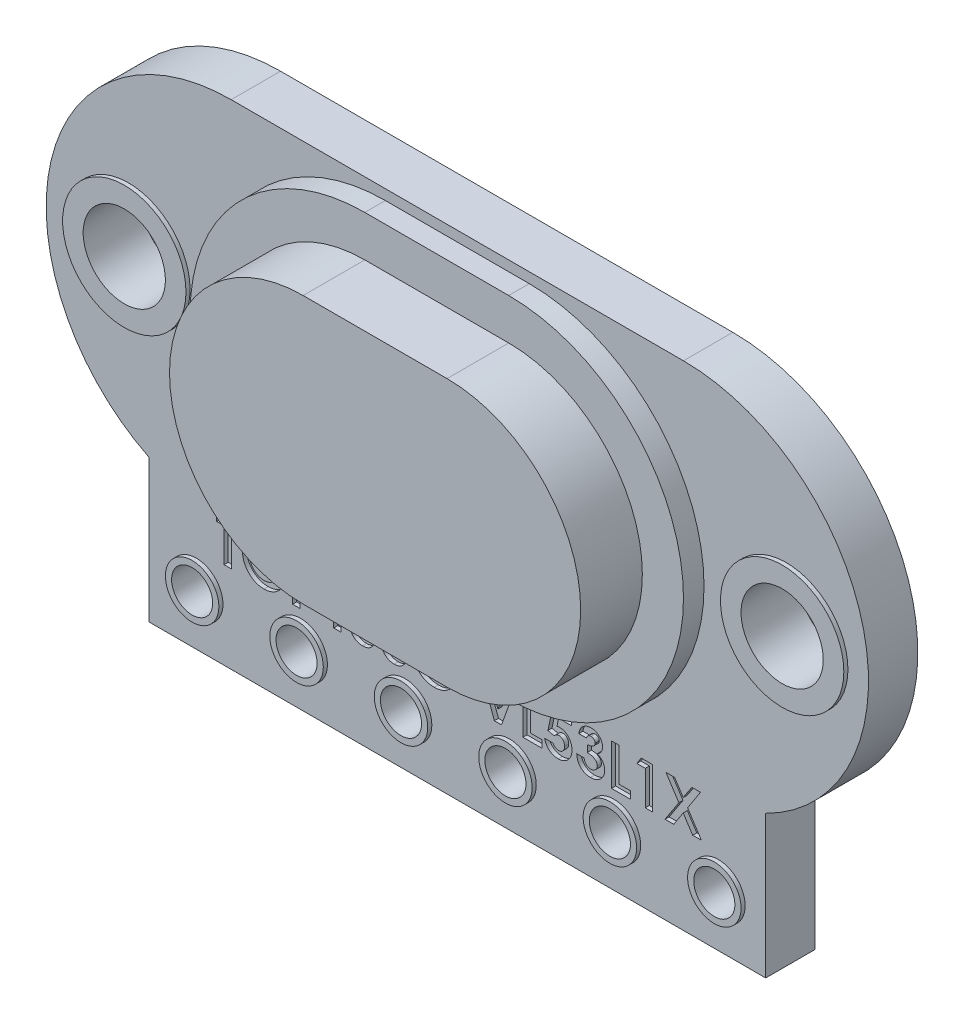
from build123d import *

# Parameters (mm, degrees)
ESQUISSE1_R             = 1
ESQUISSE1_R_2           = 0.5
BOSS_EXTRU_1_DEPTH      = 0.6
BOSS_EXTRU_2_DEPTH      = 0.5
BOSS_EXTRU_4_DEPTH      = 1.5
ESQUISSE3_R             = 1.5
ESQUISSE3_R_2           = 1
ESQUISSE3_R_3           = 0.65
ESQUISSE3_R_4           = 0.5
BOSS_EXTRU_3_DEPTH      = 0.1
ESQUISSE5_W             = 0.346153846
ESQUISSE5_H             = 0.166666667
ENL_V_MAT_EXTRU_1_DEPTH = 0.1
ESQUISSE6_W             = 1.46
ESQUISSE6_H             = 0.243333334
ESQUISSE6_H_2           = 0.243333333
ENL_V_MAT_EXTRU_2_DEPTH = 0.1


with BuildPart() as part:
    # Esquisse1 → Boss.-Extru.1 (new, symmetric)
    with BuildSketch(Plane.XY):
        with BuildLine():
            Line((-7.5, -4.031128874), (-7.5, -7.5))
            Line((-7.5, -7.5), (7.5, -7.5))
            Line((7.5, -7.5), (7.5, -4.031128874))
            ThreePointArc((7.5, -4.031128874), (9.88121444, 1.027112473), (5.5, 4.5))
            Line((5.5, 4.5), (-5.5, 4.5))
            ThreePointArc((-5.5, 4.5), (-9.88121444, 1.027112473), (-7.5, -4.031128874))
        make_face()
        with Locations((-8, 0)):
            Circle(ESQUISSE1_R, mode=Mode.SUBTRACT)
        with Locations(Location((8, 0, 0), (0, 0, 180))):
            Circle(ESQUISSE1_R, mode=Mode.SUBTRACT)
        with Locations((-6.35, -6.23)):
            Circle(ESQUISSE1_R_2, mode=Mode.SUBTRACT)
        with Locations((-3.81, -6.23)):
            Circle(ESQUISSE1_R_2, mode=Mode.SUBTRACT)
        with Locations((-1.27, -6.23)):
            Circle(ESQUISSE1_R_2, mode=Mode.SUBTRACT)
        with Locations((1.27, -6.23)):
            Circle(ESQUISSE1_R_2, mode=Mode.SUBTRACT)
        with Locations((3.81, -6.23)):
            Circle(ESQUISSE1_R_2, mode=Mode.SUBTRACT)
        with Locations((6.35, -6.23)):
            Circle(ESQUISSE1_R_2, mode=Mode.SUBTRACT)
    extrude(amount=BOSS_EXTRU_1_DEPTH, both=True)

    # Esquisse2 → Boss.-Extru.2 (add)
    with BuildSketch(Plane.XY.offset(0.6)):
        with BuildLine():
            Line((-1.75, 4.25), (1.75, 4.25))
            ThreePointArc((1.75, 4.25), (6, 0), (1.75, -4.25))
            Line((1.75, -4.25), (-1.75, -4.25))
            ThreePointArc((-1.75, -4.25), (-6, 0), (-1.75, 4.25))
        make_face()
    extrude(amount=BOSS_EXTRU_2_DEPTH)

    # Esquisse4 → Boss.-Extru.4 (add)
    with BuildSketch(Plane.XY.offset(1.1)):
        with BuildLine():
            Line((-1.75, -3.25), (1.75, -3.25))
            ThreePointArc((1.75, -3.25), (5, 0), (1.75, 3.25))
            Line((1.75, 3.25), (-1.75, 3.25))
            ThreePointArc((-1.75, 3.25), (-5, 0), (-1.75, -3.25))
        make_face()
    extrude(amount=BOSS_EXTRU_4_DEPTH)

    # Esquisse3 → Boss.-Extru.3 (add)
    # profile 1 of 8: a face of its own
    with BuildSketch(Plane.XY.offset(0.6)):
        with Locations((-8, 0)):
            Circle(ESQUISSE3_R)
        with Locations((-8, 0)):
            Circle(ESQUISSE3_R_2, mode=Mode.SUBTRACT)
    # profile 2 of 8: a face of its own
    with BuildSketch(Plane.XY.offset(0.6)):
        with Locations((8, 0)):
            Circle(ESQUISSE3_R)
        with Locations(Location((8, 0, 0), (0, 0, 180))):
            Circle(ESQUISSE3_R_2, mode=Mode.SUBTRACT)
    # profile 3 of 8: a face of its own
    with BuildSketch(Plane.XY.offset(0.6)):
        with Locations((-6.35, -6.23)):
            Circle(ESQUISSE3_R_3)
        with Locations((-6.35, -6.23)):
            Circle(ESQUISSE3_R_4, mode=Mode.SUBTRACT)
    # profile 4 of 8: a face of its own
    with BuildSketch(Plane.XY.offset(0.6)):
        with Locations((-3.81, -6.23)):
            Circle(ESQUISSE3_R_3)
        with Locations((-3.81, -6.23)):
            Circle(ESQUISSE3_R_4, mode=Mode.SUBTRACT)
    # profile 5 of 8: a face of its own
    with BuildSketch(Plane.XY.offset(0.6)):
        with Locations((-1.27, -6.23)):
            Circle(ESQUISSE3_R_3)
        with Locations((-1.27, -6.23)):
            Circle(ESQUISSE3_R_4, mode=Mode.SUBTRACT)
    # profile 6 of 8: a face of its own
    with BuildSketch(Plane.XY.offset(0.6)):
        with Locations((1.27, -6.23)):
            Circle(ESQUISSE3_R_3)
        with Locations((1.27, -6.23)):
            Circle(ESQUISSE3_R_4, mode=Mode.SUBTRACT)
    # profile 7 of 8: a face of its own
    with BuildSketch(Plane.XY.offset(0.6)):
        with Locations((3.81, -6.23)):
            Circle(ESQUISSE3_R_3)
        with Locations((3.81, -6.23)):
            Circle(ESQUISSE3_R_4, mode=Mode.SUBTRACT)
    # profile 8 of 8: a face of its own
    with BuildSketch(Plane.XY.offset(0.6)):
        with Locations((6.35, -6.23)):
            Circle(ESQUISSE3_R_3)
        with Locations((6.35, -6.23)):
            Circle(ESQUISSE3_R_4, mode=Mode.SUBTRACT)
    boss_extru_3 = extrude(amount=BOSS_EXTRU_3_DEPTH)

    # Esquisse5 → Enlèv. mat.-Extru.1 (cut)
    # profile 1 of 15: a face of its own
    with BuildSketch(Plane.XY.offset(0.6)):
        Polygon((-5.852564103, -4.381170241), (-5.314102564, -4.381170241), (-5.314102564, -4.56065742), (-5.493589744, -4.56065742), (-5.493589744, -5.381170241), (-5.673076923, -5.381170241), (-5.673076923, -4.56065742), (-5.852564103, -4.56065742), align=None)
    # profile 2 of 15: a face of its own
    with BuildSketch(Plane.XY.offset(0.6)):
        with BuildLine():
            add(Edge.make_bspline(
                [(-4.703125, -4.355529215), (-4.685738774, -4.355979376), (-4.651414427, -4.356868095), (-4.600935699, -4.364276259), (-4.552290111, -4.376346802), (-4.50549966, -4.39312573), (-4.460681505, -4.4150675), (-4.417677556, -4.441550051), (-4.376641853, -4.473073223), (-4.337994895, -4.508901634), (-4.302278136, -4.547863467), (-4.271329543, -4.589812806), (-4.244937718, -4.633662703), (-4.223064104, -4.679530655), (-4.206403275, -4.727734318), (-4.194711682, -4.778027919), (-4.187200413, -4.830397149), (-4.186336501, -4.866053456), (-4.185897436, -4.884175049)],
                knots=[0, 0, 0, 0, 1.014329547, 2.002516266, 2.970391464, 3.935626869, 4.897733899, 5.877609409, 6.878433252, 7.912639331, 8.949961323, 9.958554974, 10.949718813, 11.932905612, 12.9188844, 13.919928257, 14.942845884, 16, 16, 16, 16], degree=3))
            add(Edge.make_bspline(
                [(-4.185897436, -4.884175049), (-4.186365022, -4.902092452), (-4.187286414, -4.937399272), (-4.194405039, -4.989285898), (-4.20629352, -5.03904075), (-4.222671768, -5.086776447), (-4.244148678, -5.132261775), (-4.270025833, -5.175787152), (-4.300986082, -5.21694865), (-4.335900184, -5.255724183), (-4.374337579, -5.290921298), (-4.415048883, -5.321938696), (-4.457846115, -5.348221668), (-4.502666635, -5.369758176), (-4.549606556, -5.386471867), (-4.598549933, -5.39826459), (-4.649493737, -5.405431266), (-4.684137994, -5.40634664), (-4.701722756, -5.406811266)],
                knots=[0, 0, 0, 0, 1.051557043, 2.072126891, 3.067553643, 4.050577992, 5.02905126, 6.015227836, 7.017913613, 8.04756643, 9.074058332, 10.072836633, 11.047628519, 12.017157415, 12.98668631, 13.966869689, 14.968021931, 16, 16, 16, 16], degree=3))
            add(Edge.make_bspline(
                [(-4.701722756, -5.406811266), (-4.720114309, -5.406394474), (-4.756251197, -5.405575533), (-4.809137694, -5.397787779), (-4.859807527, -5.386056701), (-4.907835042, -5.368548696), (-4.953709357, -5.346662218), (-4.997093421, -5.319707708), (-5.037972653, -5.28772971), (-5.076112563, -5.251547193), (-5.110667414, -5.211955584), (-5.141168848, -5.17013056), (-5.166897484, -5.126391627), (-5.187854264, -5.080718315), (-5.204375747, -5.033394473), (-5.216029776, -4.984131883), (-5.222914089, -4.933048696), (-5.223873034, -4.898351975), (-5.224358974, -4.8807696)],
                knots=[0, 0, 0, 0, 1.067978421, 2.098431617, 3.099715153, 4.085208694, 5.062210972, 6.048429807, 7.046490867, 8.072918869, 9.098532598, 10.095778865, 11.076610158, 12.041847152, 13.011192615, 13.984257998, 14.978533688, 16, 16, 16, 16], degree=3))
            add(Edge.make_bspline(
                [(-5.224358974, -4.8807696), (-5.224206458, -4.868941098), (-5.223903358, -4.845433871), (-5.220252189, -4.81059736), (-5.214995557, -4.776440811), (-5.207221246, -4.743100407), (-5.197777447, -4.710340946), (-5.18554167, -4.678467362), (-5.171614044, -4.647139158), (-5.155340926, -4.616726357), (-5.137246791, -4.587508784), (-5.117504479, -4.559624264), (-5.096064348, -4.53340996), (-5.072995464, -4.508693603), (-5.048218328, -4.485637656), (-5.022058859, -4.463915729), (-4.994009713, -4.444104834), (-4.9646848, -4.425721149), (-4.934249446, -4.409097102), (-4.902827551, -4.394947211), (-4.871066469, -4.382590351), (-4.838541913, -4.372837772), (-4.805602442, -4.364894398), (-4.771896165, -4.359641308), (-4.737727598, -4.355990241), (-4.714686572, -4.355683255), (-4.703125, -4.355529215)],
                knots=[0, 0, 0, 0, 1.034744296, 2.056386356, 3.06226378, 4.057406941, 5.050368692, 6.043467995, 7.042652155, 8.049140477, 9.059438543, 10.048523776, 11.036952808, 12.020949711, 13.004946614, 13.997082645, 14.994316842, 16.007702937, 17.024872941, 18.026463647, 19.021641123, 20.005082605, 20.995858141, 21.984425357, 22.988620895, 24, 24, 24, 24], degree=3))
        make_face()
        with BuildLine():
            add(Edge.make_bspline(
                [(-4.705929487, -4.535016395), (-4.717630415, -4.535330357), (-4.740723363, -4.535949993), (-4.774596513, -4.540670778), (-4.807115934, -4.548210409), (-4.838101356, -4.559131473), (-4.867687074, -4.573031216), (-4.895925534, -4.589861069), (-4.922425693, -4.610199542), (-4.947540902, -4.632954751), (-4.970228362, -4.658309283), (-4.990273448, -4.685480977), (-5.007047956, -4.714424455), (-5.021096712, -4.74487084), (-5.031672311, -4.777162493), (-5.039204994, -4.81104647), (-5.043965368, -4.846581156), (-5.044565419, -4.870805104), (-5.044871795, -4.883173446)],
                knots=[0, 0, 0, 0, 1.033739768, 2.040188636, 3.016340934, 3.979330865, 4.937572243, 5.900995986, 6.878200029, 7.884839167, 8.891893314, 9.879764717, 10.863503415, 11.843163062, 12.837761627, 13.859916423, 14.907309254, 16, 16, 16, 16], degree=3))
            add(Edge.make_bspline(
                [(-5.044871795, -4.883173446), (-5.044465587, -4.896880351), (-5.043669487, -4.923743613), (-5.038068031, -4.962931016), (-5.028484496, -4.999939628), (-5.014646059, -5.034588447), (-4.997482767, -5.067262221), (-4.976168681, -5.097560488), (-4.95104899, -5.125664657), (-4.931696983, -5.142073042), (-4.921875, -5.15040101)],
                knots=[0, 0, 0, 0, 1.078454662, 2.113592447, 3.107694534, 4.079536787, 5.043276885, 6.005368276, 6.987637804, 8, 8, 8, 8], degree=3))
            add(Edge.make_bspline(
                [(-4.921875, -5.15040101), (-4.91382892, -5.156553393), (-4.897918041, -5.168719544), (-4.872520813, -5.184312962), (-4.846366669, -5.197678078), (-4.819258243, -5.208476933), (-4.791252788, -5.216971131), (-4.762354143, -5.222919478), (-4.732603254, -5.22665258), (-4.71248431, -5.227098756), (-4.702323718, -5.227324087)],
                knots=[0, 0, 0, 0, 1.023928204, 2.024787132, 3.009472467, 3.9914905, 4.972207045, 5.96565515, 6.972602802, 8, 8, 8, 8], degree=3))
            add(Edge.make_bspline(
                [(-4.702323718, -5.227324087), (-4.690823988, -5.227007463), (-4.668197908, -5.226384495), (-4.634955325, -5.221721825), (-4.603107921, -5.213830903), (-4.572457984, -5.203005643), (-4.543093896, -5.188931377), (-4.515159166, -5.171579514), (-4.488604817, -5.151163112), (-4.463521603, -5.128109078), (-4.440594361, -5.102654666), (-4.420591105, -5.075338041), (-4.403283251, -5.046761071), (-4.389526639, -5.016519292), (-4.378533221, -4.984898171), (-4.371091199, -4.951757666), (-4.36629061, -4.917234394), (-4.36569039, -4.893740088), (-4.365384615, -4.881771202)],
                knots=[0, 0, 0, 0, 1.026359118, 2.019393844, 2.989460624, 3.950973911, 4.916101784, 5.890408035, 6.881132271, 7.902007068, 8.92769091, 9.933912415, 10.920395702, 11.90457117, 12.894218921, 13.903490204, 14.931958862, 16, 16, 16, 16], degree=3))
            add(Edge.make_bspline(
                [(-4.365384615, -4.881771202), (-4.36570097, -4.869871141), (-4.366323666, -4.846447686), (-4.370994543, -4.812013173), (-4.378835422, -4.779018974), (-4.389693189, -4.747411204), (-4.403557983, -4.717158878), (-4.420703208, -4.688368379), (-4.441068702, -4.661067541), (-4.464185756, -4.635442409), (-4.489347248, -4.611894555), (-4.516360624, -4.591459297), (-4.544470019, -4.573701709), (-4.5743204, -4.55979113), (-4.605301053, -4.548708602), (-4.637601023, -4.54054727), (-4.67134265, -4.535983156), (-4.694297776, -4.535341521), (-4.705929487, -4.535016395)],
                knots=[0, 0, 0, 0, 1.055025985, 2.07665775, 3.074803781, 4.057872707, 5.035505728, 6.020516407, 7.023567878, 8.050795229, 9.077271434, 10.074415901, 11.050397877, 12.019801805, 12.988065821, 13.964604439, 14.968634123, 16, 16, 16, 16], degree=3))
        make_face(mode=Mode.SUBTRACT)
    # profile 3 of 15: a face of its own
    with BuildSketch(Plane.XY.offset(0.6)):
        Polygon((-4.006410256, -4.381170241), (-3.519230769, -4.381170241), (-3.519230769, -4.56065742), (-3.826923077, -4.56065742), (-3.826923077, -4.752965113), (-3.519230769, -4.752965113), (-3.519230769, -4.932452292), (-3.826923077, -4.932452292), (-3.826923077, -5.381170241), (-4.006410256, -5.381170241), align=None)
    # profile 4 of 15: a face of its own
    with BuildSketch(Plane.XY.offset(0.6)):
        Polygon((-3.014022436, -4.355529215), (-2.826923077, -4.355529215), (-2.826923077, -5.009375369), (-2.737179487, -5.009375369), (-2.737179487, -5.176042036), (-2.826923077, -5.176042036), (-2.826923077, -5.381170241), (-3.006410256, -5.381170241), (-3.006410256, -5.176042036), (-3.429487179, -5.176042036), (-3.429487179, -4.994351331), align=None)
        Polygon((-3.006410256, -5.009375369), (-3.006410256, -4.669030818), (-3.227764423, -5.009375369), align=None, mode=Mode.SUBTRACT)
    # profile 5 of 15: a face of its own
    with BuildSketch(Plane.XY.offset(0.6)):
        with BuildLine():
            add(Edge.make_bspline(
                [(-2.310697115, -4.355529215), (-2.302009191, -4.35565819), (-2.28492641, -4.355911789), (-2.25976669, -4.358658469), (-2.235530923, -4.362807937), (-2.212124296, -4.368594998), (-2.189715292, -4.376253967), (-2.168140815, -4.385421622), (-2.147657662, -4.396578825), (-2.128004609, -4.409181459), (-2.109189224, -4.423449426), (-2.091663724, -4.439715646), (-2.075108055, -4.457605832), (-2.059880587, -4.477390451), (-2.045644102, -4.498889542), (-2.032445379, -4.522106512), (-2.020385458, -4.547154995), (-2.009329176, -4.574080191), (-1.999442613, -4.603285698), (-1.991115174, -4.635106516), (-1.983973001, -4.669549911), (-1.977944503, -4.706701619), (-1.973387933, -4.746611023), (-1.970316714, -4.789251608), (-1.968209097, -4.834541171), (-1.968037088, -4.865609439), (-1.967948718, -4.881570882)],
                knots=[0, 0, 0, 0, 0.879237366, 1.728815576, 2.559023295, 3.367336655, 4.166867292, 4.954216142, 5.737608147, 6.525189134, 7.316157332, 8.124696809, 8.942788509, 9.781158001, 10.649253743, 11.551476218, 12.482711956, 13.461909668, 14.496590415, 15.601789533, 16.789733467, 18.056700938, 19.410929216, 20.8549011, 22.384193279, 24, 24, 24, 24], degree=3))
            add(Edge.make_bspline(
                [(-1.967948718, -4.881570882), (-1.968044222, -4.89773202), (-1.968229786, -4.929132822), (-1.970229099, -4.974836626), (-1.973672012, -5.017786808), (-1.978109486, -5.057978924), (-1.984187613, -5.09539175), (-1.991305943, -5.130122158), (-1.999764829, -5.162157562), (-2.009977051, -5.191425777), (-2.02096641, -5.218398259), (-2.03305932, -5.243397903), (-2.046045004, -5.266492421), (-2.05962561, -5.288030225), (-2.074545676, -5.307376392), (-2.090079001, -5.325188792), (-2.106901933, -5.340788928), (-2.124306162, -5.354980762), (-2.142929275, -5.367245355), (-2.162579217, -5.377971765), (-2.183606313, -5.386672158), (-2.205627273, -5.394239295), (-2.229017451, -5.399671682), (-2.253405178, -5.403982104), (-2.279065788, -5.406364307), (-2.296536565, -5.406659835), (-2.305488782, -5.406811266)],
                knots=[0, 0, 0, 0, 1.643780988, 3.193836972, 4.651895693, 6.025988579, 7.305620092, 8.505800249, 9.631074763, 10.672816429, 11.65661981, 12.592235626, 13.49536222, 14.350718032, 15.179365177, 15.97804903, 16.751647189, 17.51006938, 18.259804725, 19.016521909, 19.783502495, 20.571750527, 21.382245291, 22.22305063, 23.089471752, 24, 24, 24, 24], degree=3))
            add(Edge.make_bspline(
                [(-2.305488782, -5.406811266), (-2.314440757, -5.406656914), (-2.331977545, -5.406354539), (-2.357707544, -5.403999816), (-2.382224514, -5.399654221), (-2.405799745, -5.394197589), (-2.428269158, -5.386688901), (-2.449740492, -5.377728198), (-2.470048651, -5.367068716), (-2.489249865, -5.354775548), (-2.507278577, -5.340678668), (-2.524414951, -5.324928859), (-2.540621083, -5.307566041), (-2.555650435, -5.288395737), (-2.569749145, -5.26767383), (-2.582770187, -5.245163686), (-2.594705734, -5.22089808), (-2.605929133, -5.194843188), (-2.615680846, -5.166438078), (-2.624359418, -5.135429095), (-2.631468676, -5.101557755), (-2.637186417, -5.064834939), (-2.641751458, -5.025338445), (-2.645147324, -4.98304921), (-2.647157743, -4.937947537), (-2.64734136, -4.906946911), (-2.647435897, -4.890985946)],
                knots=[0, 0, 0, 0, 0.917216111, 1.796812873, 2.643793957, 3.46689424, 4.273913431, 5.068098542, 5.848489301, 6.620921603, 7.401012384, 8.190319798, 9.003608147, 9.831726257, 10.68377682, 11.569763213, 12.493818149, 13.453288342, 14.474581811, 15.568529029, 16.750744269, 18.018426408, 19.375425659, 20.823733699, 22.36466933, 24, 24, 24, 24], degree=3))
            add(Edge.make_bspline(
                [(-2.647435897, -4.890985946), (-2.647264652, -4.868809442), (-2.646934233, -4.826019591), (-2.642746913, -4.764200697), (-2.636600989, -4.707059839), (-2.627574082, -4.654692598), (-2.616412438, -4.606905022), (-2.60211937, -4.56401191), (-2.585847753, -4.52541974), (-2.571982244, -4.502557506), (-2.565304487, -4.491546843)],
                knots=[0, 0, 0, 0, 1.288568992, 2.486310467, 3.599230591, 4.627010532, 5.572937695, 6.447898582, 7.252493626, 8, 8, 8, 8], degree=3))
            add(Edge.make_bspline(
                [(-2.565304487, -4.491546843), (-2.557539909, -4.480729972), (-2.54235863, -4.459580856), (-2.515813739, -4.43181602), (-2.487294709, -4.408070172), (-2.456215776, -4.388880704), (-2.423068467, -4.373747887), (-2.387568195, -4.363059749), (-2.349846056, -4.356832342), (-2.323941634, -4.355970077), (-2.310697115, -4.355529215)],
                knots=[0, 0, 0, 0, 1.058512271, 2.069600068, 3.047294572, 4.004278952, 4.967380941, 5.939006123, 6.946246673, 8, 8, 8, 8], degree=3))
        make_face()
        with BuildLine():
            add(Edge.make_bspline(
                [(-2.306290064, -4.535016395), (-2.31414402, -4.535388657), (-2.329541942, -4.536118487), (-2.351885061, -4.542313722), (-2.372953228, -4.551882596), (-2.388979219, -4.56339724), (-2.400974514, -4.574435407), (-2.409355713, -4.584424589), (-2.417438058, -4.595571797), (-2.424576792, -4.608380045), (-2.431317621, -4.62238912), (-2.437905442, -4.637662613), (-2.443305726, -4.654575675), (-2.448611362, -4.672840274), (-2.453259593, -4.692961377), (-2.457153793, -4.715103453), (-2.460632917, -4.739410494), (-2.463059648, -4.76589842), (-2.46532209, -4.794539519), (-2.466943915, -4.825397592), (-2.467621959, -4.858464314), (-2.467837489, -4.881236875), (-2.467948718, -4.892989151)],
                knots=[0, 0, 0, 0, 1.076674018, 2.110852608, 3.161083442, 4.239746716, 4.804137807, 5.395870207, 6.026861976, 6.692161227, 7.405688833, 8.16177676, 8.973626916, 9.841385931, 10.773283133, 11.807421078, 12.927755683, 14.143907515, 15.458935494, 16.872852025, 18.386167141, 20, 20, 20, 20], degree=3))
            add(Edge.make_bspline(
                [(-2.467948718, -4.892989151), (-2.467765649, -4.908214793), (-2.4674146, -4.93741109), (-2.465575972, -4.979396383), (-2.461890594, -5.017606379), (-2.457306728, -5.052300044), (-2.450868501, -5.083252378), (-2.443460904, -5.110756221), (-2.434313181, -5.134460964), (-2.423741224, -5.154709431), (-2.412032305, -5.17193476), (-2.399321758, -5.186576368), (-2.386042333, -5.199255309), (-2.371779534, -5.209554257), (-2.356567389, -5.217446896), (-2.340532891, -5.223123973), (-2.32366585, -5.226599149), (-2.312115475, -5.227081044), (-2.306290064, -5.227324087)],
                knots=[0, 0, 0, 0, 1.771748488, 3.397459088, 4.888034009, 6.237357457, 7.467047327, 8.564189669, 9.548206622, 10.417051504, 11.216568818, 11.965764335, 12.669334354, 13.348544111, 14.005342236, 14.656555988, 15.322436492, 16, 16, 16, 16], degree=3))
            add(Edge.make_bspline(
                [(-2.306290064, -5.227324087), (-2.300664563, -5.227157779), (-2.289650532, -5.226832169), (-2.273589607, -5.223489821), (-2.258401256, -5.21805589), (-2.244131336, -5.210369214), (-2.230728806, -5.200594428), (-2.218259169, -5.188688579), (-2.206816469, -5.174532993), (-2.2001499, -5.164027455), (-2.196714744, -5.158614151)],
                knots=[0, 0, 0, 0, 0.992283464, 1.942767638, 2.88273346, 3.832339453, 4.79467288, 5.803907806, 6.868395428, 8, 8, 8, 8], degree=3))
            add(Edge.make_bspline(
                [(-2.196714744, -5.158614151), (-2.192670426, -5.151217044), (-2.184189819, -5.13570591), (-2.174376046, -5.10953145), (-2.166115359, -5.080010985), (-2.159005506, -5.047052645), (-2.1541428, -5.010526438), (-2.149955044, -4.970663979), (-2.147935186, -4.927264539), (-2.147606645, -4.897197249), (-2.147435897, -4.881570882)],
                knots=[0, 0, 0, 0, 0.710965849, 1.490837728, 2.352621235, 3.297892224, 4.334225155, 5.461620853, 6.680770821, 8, 8, 8, 8], degree=3))
            add(Edge.make_bspline(
                [(-2.147435897, -4.881570882), (-2.147501853, -4.86580887), (-2.147628807, -4.835469688), (-2.149958044, -4.791914223), (-2.153201683, -4.752133534), (-2.157946191, -4.716216436), (-2.164050863, -4.684075738), (-2.171574895, -4.65571354), (-2.180445168, -4.631073946), (-2.190964255, -4.610181525), (-2.202614798, -4.592425834), (-2.214982204, -4.577192827), (-2.228118769, -4.564187271), (-2.242002524, -4.553360222), (-2.256954813, -4.545087545), (-2.272690028, -4.539246351), (-2.289240428, -4.535712624), (-2.300530143, -4.535251604), (-2.306290064, -4.535016395)],
                knots=[0, 0, 0, 0, 1.793836731, 3.452829483, 4.963243077, 6.335886805, 7.574563692, 8.684454726, 9.672768357, 10.54971625, 11.340229787, 12.085688095, 12.778991901, 13.440269426, 14.083255152, 14.715733572, 15.344777694, 16, 16, 16, 16], degree=3))
        make_face(mode=Mode.SUBTRACT)
    # profile 6 of 15: a face of its own
    with BuildSketch(Plane.XY.offset(0.6)):
        with BuildLine():
            add(Edge.make_bspline(
                [(-1.541466346, -4.355529215), (-1.532778422, -4.35565819), (-1.515695641, -4.355911789), (-1.490535921, -4.358658469), (-1.466300154, -4.362807937), (-1.442893527, -4.368594998), (-1.420484523, -4.376253967), (-1.398910046, -4.385421622), (-1.378426893, -4.396578825), (-1.358773839, -4.409181459), (-1.339958455, -4.423449426), (-1.322432955, -4.439715646), (-1.305877286, -4.457605832), (-1.290649817, -4.477390451), (-1.276413332, -4.498889542), (-1.26321461, -4.522106512), (-1.251154689, -4.547154995), (-1.240098406, -4.574080191), (-1.230211844, -4.603285698), (-1.221884404, -4.635106516), (-1.214742232, -4.669549911), (-1.208713734, -4.706701619), (-1.204157164, -4.746611023), (-1.201085944, -4.789251608), (-1.198978328, -4.834541171), (-1.198806319, -4.865609439), (-1.198717949, -4.881570882)],
                knots=[0, 0, 0, 0, 0.879237366, 1.728815576, 2.559023295, 3.367336655, 4.166867292, 4.954216142, 5.737608147, 6.525189134, 7.316157332, 8.124696809, 8.942788509, 9.781158001, 10.649253743, 11.551476218, 12.482711956, 13.461909668, 14.496590415, 15.601789533, 16.789733467, 18.056700938, 19.410929216, 20.8549011, 22.384193279, 24, 24, 24, 24], degree=3))
            add(Edge.make_bspline(
                [(-1.198717949, -4.881570882), (-1.198813453, -4.89773202), (-1.198999016, -4.929132822), (-1.20099833, -4.974836626), (-1.204441243, -5.017786808), (-1.208878717, -5.057978924), (-1.214956843, -5.09539175), (-1.222075174, -5.130122158), (-1.230534059, -5.162157562), (-1.240746282, -5.191425777), (-1.25173564, -5.218398259), (-1.263828551, -5.243397903), (-1.276814235, -5.266492421), (-1.290394841, -5.288030225), (-1.305314907, -5.307376392), (-1.320848231, -5.325188792), (-1.337671164, -5.340788928), (-1.355075393, -5.354980762), (-1.373698506, -5.367245355), (-1.393348448, -5.377971765), (-1.414375544, -5.386672158), (-1.436396504, -5.394239295), (-1.459786681, -5.399671682), (-1.484174409, -5.403982104), (-1.509835019, -5.406364307), (-1.527305796, -5.406659835), (-1.536258013, -5.406811266)],
                knots=[0, 0, 0, 0, 1.643780988, 3.193836972, 4.651895693, 6.025988579, 7.305620092, 8.505800249, 9.631074763, 10.672816429, 11.65661981, 12.592235626, 13.49536222, 14.350718032, 15.179365177, 15.97804903, 16.751647189, 17.51006938, 18.259804725, 19.016521909, 19.783502495, 20.571750527, 21.382245291, 22.22305063, 23.089471752, 24, 24, 24, 24], degree=3))
            add(Edge.make_bspline(
                [(-1.536258013, -5.406811266), (-1.545209988, -5.406656914), (-1.562746776, -5.406354539), (-1.588476775, -5.403999816), (-1.612993745, -5.399654221), (-1.636568976, -5.394197589), (-1.659038388, -5.386688901), (-1.680509722, -5.377728198), (-1.700817881, -5.367068716), (-1.720019096, -5.354775548), (-1.738047808, -5.340678668), (-1.755184182, -5.324928859), (-1.771390313, -5.307566041), (-1.786419666, -5.288395737), (-1.800518376, -5.26767383), (-1.813539418, -5.245163686), (-1.825474965, -5.22089808), (-1.836698364, -5.194843188), (-1.846450077, -5.166438078), (-1.855128649, -5.135429095), (-1.862237907, -5.101557755), (-1.867955648, -5.064834939), (-1.872520689, -5.025338445), (-1.875916555, -4.98304921), (-1.877926974, -4.937947537), (-1.878110591, -4.906946911), (-1.878205128, -4.890985946)],
                knots=[0, 0, 0, 0, 0.917216111, 1.796812873, 2.643793957, 3.46689424, 4.273913431, 5.068098542, 5.848489301, 6.620921603, 7.401012384, 8.190319798, 9.003608147, 9.831726257, 10.68377682, 11.569763213, 12.493818149, 13.453288342, 14.474581811, 15.568529029, 16.750744269, 18.018426408, 19.375425659, 20.823733699, 22.36466933, 24, 24, 24, 24], degree=3))
            add(Edge.make_bspline(
                [(-1.878205128, -4.890985946), (-1.878033883, -4.868809442), (-1.877703463, -4.826019591), (-1.873516143, -4.764200697), (-1.86737022, -4.707059839), (-1.858343313, -4.654692598), (-1.847181668, -4.606905022), (-1.832888601, -4.56401191), (-1.816616983, -4.52541974), (-1.802751475, -4.502557506), (-1.796073718, -4.491546843)],
                knots=[0, 0, 0, 0, 1.288568992, 2.486310467, 3.599230591, 4.627010532, 5.572937695, 6.447898582, 7.252493626, 8, 8, 8, 8], degree=3))
            add(Edge.make_bspline(
                [(-1.796073718, -4.491546843), (-1.78830914, -4.480729972), (-1.773127861, -4.459580856), (-1.746582969, -4.43181602), (-1.71806394, -4.408070172), (-1.686985007, -4.388880704), (-1.653837698, -4.373747887), (-1.618337426, -4.363059749), (-1.580615286, -4.356832342), (-1.554710864, -4.355970077), (-1.541466346, -4.355529215)],
                knots=[0, 0, 0, 0, 1.058512271, 2.069600068, 3.047294572, 4.004278952, 4.967380941, 5.939006123, 6.946246673, 8, 8, 8, 8], degree=3))
        make_face()
        with BuildLine():
            add(Edge.make_bspline(
                [(-1.537059295, -4.535016395), (-1.544913251, -4.535388657), (-1.560311173, -4.536118487), (-1.582654292, -4.542313722), (-1.603722458, -4.551882596), (-1.61974845, -4.56339724), (-1.631743745, -4.574435407), (-1.640124943, -4.584424589), (-1.648207289, -4.595571797), (-1.655346023, -4.608380045), (-1.662086852, -4.62238912), (-1.668674673, -4.637662613), (-1.674074957, -4.654575675), (-1.679380592, -4.672840274), (-1.684028824, -4.692961377), (-1.687923023, -4.715103453), (-1.691402148, -4.739410494), (-1.693828879, -4.76589842), (-1.696091321, -4.794539519), (-1.697713146, -4.825397592), (-1.69839119, -4.858464314), (-1.69860672, -4.881236875), (-1.698717949, -4.892989151)],
                knots=[0, 0, 0, 0, 1.076674018, 2.110852608, 3.161083442, 4.239746716, 4.804137807, 5.395870207, 6.026861976, 6.692161227, 7.405688833, 8.16177676, 8.973626916, 9.841385931, 10.773283133, 11.807421078, 12.927755683, 14.143907515, 15.458935494, 16.872852025, 18.386167141, 20, 20, 20, 20], degree=3))
            add(Edge.make_bspline(
                [(-1.698717949, -4.892989151), (-1.69853488, -4.908214793), (-1.698183831, -4.93741109), (-1.696345203, -4.979396383), (-1.692659825, -5.017606379), (-1.688075959, -5.052300044), (-1.681637732, -5.083252378), (-1.674230135, -5.110756221), (-1.665082411, -5.134460964), (-1.654510454, -5.154709431), (-1.642801535, -5.17193476), (-1.630090989, -5.186576368), (-1.616811563, -5.199255309), (-1.602548765, -5.209554257), (-1.58733662, -5.217446896), (-1.571302122, -5.223123973), (-1.554435081, -5.226599149), (-1.542884705, -5.227081044), (-1.537059295, -5.227324087)],
                knots=[0, 0, 0, 0, 1.771748488, 3.397459088, 4.888034009, 6.237357457, 7.467047327, 8.564189669, 9.548206622, 10.417051504, 11.216568818, 11.965764335, 12.669334354, 13.348544111, 14.005342236, 14.656555988, 15.322436492, 16, 16, 16, 16], degree=3))
            add(Edge.make_bspline(
                [(-1.537059295, -5.227324087), (-1.531433794, -5.227157779), (-1.520419763, -5.226832169), (-1.504358838, -5.223489821), (-1.489170487, -5.21805589), (-1.474900567, -5.210369214), (-1.461498037, -5.200594428), (-1.4490284, -5.188688579), (-1.4375857, -5.174532993), (-1.430919131, -5.164027455), (-1.427483974, -5.158614151)],
                knots=[0, 0, 0, 0, 0.992283464, 1.942767638, 2.88273346, 3.832339453, 4.79467288, 5.803907806, 6.868395428, 8, 8, 8, 8], degree=3))
            add(Edge.make_bspline(
                [(-1.427483974, -5.158614151), (-1.423439656, -5.151217044), (-1.414959049, -5.13570591), (-1.405145276, -5.10953145), (-1.396884589, -5.080010985), (-1.389774737, -5.047052645), (-1.384912031, -5.010526438), (-1.380724275, -4.970663979), (-1.378704416, -4.927264539), (-1.378375875, -4.897197249), (-1.378205128, -4.881570882)],
                knots=[0, 0, 0, 0, 0.710965849, 1.490837728, 2.352621235, 3.297892224, 4.334225155, 5.461620853, 6.680770821, 8, 8, 8, 8], degree=3))
            add(Edge.make_bspline(
                [(-1.378205128, -4.881570882), (-1.378271084, -4.86580887), (-1.378398038, -4.835469688), (-1.380727274, -4.791914223), (-1.383970914, -4.752133534), (-1.388715422, -4.716216436), (-1.394820094, -4.684075738), (-1.402344125, -4.65571354), (-1.411214399, -4.631073946), (-1.421733486, -4.610181525), (-1.433384028, -4.592425834), (-1.445751435, -4.577192827), (-1.458888, -4.564187271), (-1.472771755, -4.553360222), (-1.487724044, -4.545087545), (-1.503459259, -4.539246351), (-1.520009658, -4.535712624), (-1.531299374, -4.535251604), (-1.537059295, -4.535016395)],
                knots=[0, 0, 0, 0, 1.793836731, 3.452829483, 4.963243077, 6.335886805, 7.574563692, 8.684454726, 9.672768357, 10.54971625, 11.340229787, 12.085688095, 12.778991901, 13.440269426, 14.083255152, 14.715733572, 15.344777694, 16, 16, 16, 16], degree=3))
        make_face(mode=Mode.SUBTRACT)
    # profile 7 of 15: a face of its own
    with BuildSketch(Plane.XY.offset(0.6)):
        with BuildLine():
            Line((-0.134615385, -4.554647805), (-0.266225962, -4.680449087))
            add(Edge.make_bspline(
                [(-0.266225962, -4.680449087), (-0.277390243, -4.668905201), (-0.299197582, -4.646356376), (-0.334337412, -4.616503719), (-0.370881556, -4.591625568), (-0.40811912, -4.570673348), (-0.4467199, -4.5548215), (-0.486237567, -4.543269992), (-0.526924451, -4.536227473), (-0.554459769, -4.535421685), (-0.568309295, -4.535016395)],
                knots=[0, 0, 0, 0, 1.115251505, 2.178435587, 3.19620269, 4.182487026, 5.141301733, 6.088180966, 7.038406374, 8, 8, 8, 8], degree=3))
            add(Edge.make_bspline(
                [(-0.568309295, -4.535016395), (-0.579875332, -4.535336588), (-0.602699631, -4.535968454), (-0.636211684, -4.540600657), (-0.668267695, -4.54847792), (-0.698977396, -4.559334247), (-0.728250422, -4.573381758), (-0.756148149, -4.59060958), (-0.782601796, -4.610862123), (-0.807261925, -4.634034597), (-0.829820145, -4.659352267), (-0.849751768, -4.686366161), (-0.8664477, -4.71501439), (-0.880149779, -4.745006828), (-0.89082317, -4.776482293), (-0.898445311, -4.809419595), (-0.902853754, -4.843857961), (-0.903511744, -4.867268905), (-0.903846154, -4.879167036)],
                knots=[0, 0, 0, 0, 1.035432265, 2.043311493, 3.022114605, 3.98653278, 4.95457646, 5.923598177, 6.917315552, 7.932509744, 8.948865224, 9.949768934, 10.933144597, 11.912367597, 12.897413939, 13.903909035, 14.934704909, 16, 16, 16, 16], degree=3))
            add(Edge.make_bspline(
                [(-0.903846154, -4.879167036), (-0.903749781, -4.887517976), (-0.903559827, -4.903977852), (-0.901480453, -4.928326576), (-0.898132169, -4.951950594), (-0.893286373, -4.974814123), (-0.887226658, -4.996936976), (-0.880117232, -5.018510007), (-0.871198562, -5.039235123), (-0.861298704, -5.059353035), (-0.849785283, -5.078314799), (-0.837371691, -5.096396415), (-0.823911177, -5.113509248), (-0.809316556, -5.129583341), (-0.793382429, -5.144367491), (-0.776520632, -5.158306276), (-0.758446731, -5.17105076), (-0.739536166, -5.182920781), (-0.719625574, -5.193232369), (-0.699255175, -5.202572676), (-0.678116114, -5.210158393), (-0.65646577, -5.216273174), (-0.634381516, -5.221472881), (-0.611647345, -5.224674501), (-0.588460335, -5.22709905), (-0.572789809, -5.227248752), (-0.564903846, -5.227324087)],
                knots=[0, 0, 0, 0, 1.103660481, 2.175337485, 3.227646561, 4.255952547, 5.262355991, 6.258840057, 7.255597736, 8.242457506, 9.22035537, 10.185017736, 11.140346927, 12.096287581, 13.051739095, 14.01125915, 14.986044842, 15.97314143, 16.960198552, 17.947847494, 18.933482797, 19.925264591, 20.920966487, 21.929612487, 22.958107872, 24, 24, 24, 24], degree=3))
            add(Edge.make_bspline(
                [(-0.564903846, -5.227324087), (-0.551527898, -5.226937184), (-0.52524764, -5.226177019), (-0.486677581, -5.22023264), (-0.449924157, -5.210454473), (-0.420558348, -5.198907025), (-0.397551012, -5.187503771), (-0.380035867, -5.176956322), (-0.361923842, -5.165157843), (-0.343515762, -5.151663046), (-0.324604573, -5.136633873), (-0.305524101, -5.119741158), (-0.285785883, -5.101541155), (-0.272855572, -5.088551454), (-0.266225962, -5.081891395)],
                knots=[0, 0, 0, 0, 1.404581149, 2.759636711, 4.088442092, 5.392261763, 6.066678138, 6.783632037, 7.538459478, 8.336747902, 9.180226004, 10.074962426, 11.012997595, 12, 12, 12, 12], degree=3))
            Line((-0.266225962, -5.081891395), (-0.138621795, -5.215905818))
            add(Edge.make_bspline(
                [(-0.138621795, -5.215905818), (-0.147591681, -5.224565961), (-0.16509898, -5.241468709), (-0.191508255, -5.265469034), (-0.217884293, -5.287035994), (-0.243589904, -5.306952375), (-0.269046172, -5.324637964), (-0.294250398, -5.340110425), (-0.318917259, -5.353761078), (-0.343558971, -5.365359713), (-0.368328866, -5.375208158), (-0.393814177, -5.383687022), (-0.420092815, -5.390859837), (-0.447325278, -5.396647356), (-0.475257559, -5.401288165), (-0.504151066, -5.404420685), (-0.533822599, -5.406526573), (-0.55394926, -5.406715805), (-0.564102564, -5.406811266)],
                knots=[0, 0, 0, 0, 1.244526981, 2.429050516, 3.560637417, 4.644440555, 5.67424972, 6.652764056, 7.595344123, 8.486817594, 9.369275933, 10.254498637, 11.166417451, 12.086725134, 13.032340136, 13.991389299, 14.986715468, 16, 16, 16, 16], degree=3))
            add(Edge.make_bspline(
                [(-0.564102564, -5.406811266), (-0.582752925, -5.406335832), (-0.619246498, -5.405405538), (-0.672726877, -5.398512689), (-0.723531801, -5.386956951), (-0.77178487, -5.370613949), (-0.81747074, -5.34973653), (-0.860577723, -5.324141795), (-0.90103634, -5.293897744), (-0.938519765, -5.259358869), (-0.972425308, -5.22121358), (-1.002393881, -5.180256004), (-1.027183885, -5.136284851), (-1.04776756, -5.089949713), (-1.063863723, -5.041039147), (-1.075192693, -4.989500246), (-1.082179187, -4.935382773), (-1.082943519, -4.898419292), (-1.083333333, -4.879567677)],
                knots=[0, 0, 0, 0, 1.078019885, 2.10938526, 3.111377082, 4.085535484, 5.04941344, 6.010039228, 6.978205633, 7.964457913, 8.951525778, 9.924444315, 10.892603023, 11.863865945, 12.85144698, 13.863884204, 14.910567087, 16, 16, 16, 16], degree=3))
            add(Edge.make_bspline(
                [(-1.083333333, -4.879567677), (-1.083168617, -4.867272814), (-1.082842188, -4.842907401), (-1.079411398, -4.807015174), (-1.074628676, -4.772026673), (-1.067041323, -4.738305194), (-1.057895517, -4.705396447), (-1.046521506, -4.673658112), (-1.032937455, -4.642998969), (-1.017581211, -4.613367693), (-1.000208846, -4.584958401), (-0.980802007, -4.558015173), (-0.959860301, -4.532330013), (-0.936880535, -4.508243681), (-0.912196633, -4.485544696), (-0.885697151, -4.464356067), (-0.857541471, -4.444373926), (-0.827653384, -4.426113563), (-0.796613537, -4.409596094), (-0.764813425, -4.395026981), (-0.732331176, -4.382850558), (-0.699304128, -4.372750664), (-0.665592742, -4.365211807), (-0.631437642, -4.359505135), (-0.596548209, -4.35631507), (-0.573122977, -4.355792835), (-0.561298077, -4.355529215)],
                knots=[0, 0, 0, 0, 1.071919942, 2.124283339, 3.142214191, 4.149696895, 5.136002878, 6.119640489, 7.086990633, 8.058538607, 9.028339693, 9.988281803, 10.952401235, 11.916291999, 12.888973767, 13.874849856, 14.873389453, 15.898127285, 16.927174885, 17.938320013, 18.946391617, 19.950418109, 20.947802303, 21.956882652, 22.968648068, 24, 24, 24, 24], degree=3))
            add(Edge.make_bspline(
                [(-0.561298077, -4.355529215), (-0.551210225, -4.355680329), (-0.531139406, -4.355980985), (-0.501250589, -4.358487282), (-0.471600809, -4.362423397), (-0.442296221, -4.368362156), (-0.413127209, -4.375412213), (-0.384477086, -4.38464329), (-0.355893881, -4.394933065), (-0.327825879, -4.40723239), (-0.300233901, -4.420658214), (-0.273764334, -4.435890299), (-0.247972754, -4.451991279), (-0.223430689, -4.469914082), (-0.199678412, -4.489008613), (-0.176840127, -4.50936396), (-0.155116252, -4.531319505), (-0.141483554, -4.546832393), (-0.134615385, -4.554647805)],
                knots=[0, 0, 0, 0, 0.996412454, 1.982464992, 2.961075852, 3.949442424, 4.934965278, 5.923860011, 6.921385422, 7.934793307, 8.949617135, 9.951082467, 10.950285876, 11.951772932, 12.951063433, 13.960125323, 14.972308753, 16, 16, 16, 16], degree=3))
        make_face()
    # profile 8 of 15: a face of its own
    with BuildSketch(Plane.XY.offset(0.6)):
        with Locations((0.217948718, -5.015785626)):
            Rectangle(ESQUISSE5_W, ESQUISSE5_H)
    # profile 9 of 15: a face of its own
    with BuildSketch(Plane.XY.offset(0.6)):
        Polygon((0.538461538, -4.381170241), (0.730168269, -4.381170241), (0.987179487, -5.091506779), (1.244791667, -4.381170241), (1.435897436, -4.381170241), (1.073317308, -5.381170241), (0.900440705, -5.381170241), align=None)
    # profile 10 of 15: a face of its own
    with BuildSketch(Plane.XY.offset(0.6)):
        Polygon((1.596153846, -4.381170241), (1.775641026, -4.381170241), (1.775641026, -5.201683061), (2.057692308, -5.201683061), (2.057692308, -5.381170241), (1.596153846, -5.381170241), align=None)
    # profile 11 of 15: a face of its own
    with BuildSketch(Plane.XY.offset(0.6)):
        with BuildLine():
            Line((2.3203125, -4.381170241), (2.775641026, -4.381170241))
            Line((2.775641026, -4.381170241), (2.775641026, -4.547836908))
            Line((2.775641026, -4.547836908), (2.462540064, -4.547836908))
            Line((2.462540064, -4.547836908), (2.423477564, -4.736939472))
            add(Edge.make_bspline(
                [(2.423477564, -4.736939472), (2.428800389, -4.735456998), (2.439298093, -4.732533255), (2.455112897, -4.72960111), (2.470439647, -4.727700587), (2.480496966, -4.727447083), (2.485376603, -4.727324087)],
                knots=[0, 0, 0, 0, 1.05461699, 2.079921384, 3.068411212, 4, 4, 4, 4], degree=3))
            add(Edge.make_bspline(
                [(2.485376603, -4.727324087), (2.496009842, -4.727567742), (2.516970299, -4.728048038), (2.547632788, -4.732607621), (2.576993933, -4.739788825), (2.604963885, -4.750030704), (2.631515321, -4.763360775), (2.656680427, -4.779486423), (2.680490089, -4.798435972), (2.702521348, -4.820221285), (2.722764588, -4.844142053), (2.740364931, -4.870014894), (2.755396722, -4.897470887), (2.767352489, -4.926680698), (2.776788999, -4.957460869), (2.783608032, -4.989831127), (2.787640467, -5.023829833), (2.788184216, -5.04702472), (2.788461538, -5.058854536)],
                knots=[0, 0, 0, 0, 1.01440847, 1.999622559, 2.951875003, 3.895578053, 4.836219714, 5.782137149, 6.743708247, 7.735272588, 8.734977101, 9.730283169, 10.717124674, 11.717316708, 12.737475749, 13.78628267, 14.87096371, 16, 16, 16, 16], degree=3))
            add(Edge.make_bspline(
                [(2.788461538, -5.058854536), (2.788122647, -5.070818648), (2.787453914, -5.094427337), (2.783091045, -5.129140463), (2.775390502, -5.1623878), (2.764813037, -5.194258352), (2.750877903, -5.224517877), (2.734118998, -5.253479842), (2.714252973, -5.280929271), (2.691474783, -5.306584774), (2.666711901, -5.330034397), (2.640345278, -5.350663075), (2.612560147, -5.36802194), (2.583355837, -5.382050838), (2.552899902, -5.393150253), (2.5211831, -5.401230097), (2.48805129, -5.405863438), (2.465559096, -5.406491852), (2.454126603, -5.406811266)],
                knots=[0, 0, 0, 0, 1.06808661, 2.107647099, 3.116961351, 4.110378221, 5.100014249, 6.085620622, 7.093190682, 8.119403071, 9.144090782, 10.133780668, 11.103064255, 12.062861538, 13.020824475, 13.992378307, 14.979551724, 16, 16, 16, 16], degree=3))
            add(Edge.make_bspline(
                [(2.454126603, -5.406811266), (2.443902864, -5.406549965), (2.423739513, -5.406034625), (2.394039782, -5.402867071), (2.365405943, -5.397266807), (2.337990011, -5.389161774), (2.311503524, -5.37918633), (2.286252674, -5.366710151), (2.262098702, -5.351970801), (2.239110197, -5.335237274), (2.21766069, -5.316387604), (2.198083852, -5.295753393), (2.180261164, -5.273594725), (2.164574003, -5.249638229), (2.151071542, -5.223919299), (2.139097285, -5.19674104), (2.129296236, -5.167819622), (2.124322486, -5.147769689), (2.121794872, -5.137580497)],
                knots=[0, 0, 0, 0, 1.054957082, 2.080596141, 3.077793124, 4.061112343, 5.027190972, 5.994718051, 6.962465889, 7.943658696, 8.924948258, 9.904494768, 10.875059, 11.855380583, 12.854004648, 13.869083016, 14.917087635, 16, 16, 16, 16], degree=3))
            Line((2.121794872, -5.137580497), (2.326923077, -5.137580497))
            add(Edge.make_bspline(
                [(2.326923077, -5.137580497), (2.330672825, -5.144641192), (2.337960034, -5.158362846), (2.351821915, -5.176580404), (2.367339411, -5.192115555), (2.384372546, -5.20512008), (2.403031683, -5.214862849), (2.422556499, -5.222251315), (2.443192274, -5.226520835), (2.457246148, -5.227054568), (2.464342949, -5.227324087)],
                knots=[0, 0, 0, 0, 1.104910296, 2.147267069, 3.153527244, 4.136738762, 5.099945312, 6.05603338, 7.018353, 8, 8, 8, 8], degree=3))
            add(Edge.make_bspline(
                [(2.464342949, -5.227324087), (2.469289323, -5.227137981), (2.479021399, -5.226771816), (2.493360074, -5.224834707), (2.507046969, -5.221165867), (2.520183843, -5.216085376), (2.532805985, -5.209749431), (2.544732452, -5.201750712), (2.556170743, -5.192543891), (2.566946722, -5.181979032), (2.576706653, -5.170201672), (2.585265044, -5.157546095), (2.592917426, -5.144293512), (2.598585663, -5.129918955), (2.603227469, -5.114851652), (2.606645883, -5.098977947), (2.608688771, -5.0822793), (2.608877888, -5.070879601), (2.608974359, -5.065064472)],
                knots=[0, 0, 0, 0, 0.978869489, 1.925942215, 2.855067702, 3.774946051, 4.70828698, 5.642468714, 6.60995405, 7.609372294, 8.622401667, 9.629904756, 10.629323, 11.642352373, 12.678539694, 13.745912462, 14.850161547, 16, 16, 16, 16], degree=3))
            add(Edge.make_bspline(
                [(2.608974359, -5.065064472), (2.608862393, -5.059384324), (2.60864445, -5.04832778), (2.606841576, -5.032092811), (2.603616269, -5.016688765), (2.599221761, -5.001997656), (2.593596266, -4.988108697), (2.586721535, -4.974939214), (2.578568198, -4.962555774), (2.569092483, -4.95121049), (2.558987677, -4.940804274), (2.548131869, -4.93170308), (2.536622864, -4.924149721), (2.524818289, -4.917555419), (2.512246948, -4.912756229), (2.499191521, -4.909451205), (2.485665737, -4.90702611), (2.476440094, -4.906883627), (2.471754808, -4.906811266)],
                knots=[0, 0, 0, 0, 1.166249705, 2.270133367, 3.348514167, 4.393962215, 5.415026464, 6.420877785, 7.440098956, 8.453121383, 9.451844239, 10.415694839, 11.355045125, 12.27538808, 13.187007209, 14.108269027, 15.039275622, 16, 16, 16, 16], degree=3))
            add(Edge.make_bspline(
                [(2.471754808, -4.906811266), (2.466665498, -4.907004378), (2.45646543, -4.907391413), (2.441310681, -4.910540621), (2.426338657, -4.915637221), (2.411466097, -4.922668788), (2.396840637, -4.931870891), (2.382076304, -4.942663903), (2.367667292, -4.955832038), (2.358505642, -4.965639694), (2.353766026, -4.97071351)],
                knots=[0, 0, 0, 0, 0.88288272, 1.769486374, 2.674910571, 3.623812639, 4.617874466, 5.670434592, 6.794841017, 8, 8, 8, 8], degree=3))
            Line((2.353766026, -4.97071351), (2.202724359, -4.936058061))
            Line((2.202724359, -4.936058061), (2.3203125, -4.381170241))
        make_face()
    # profile 12 of 15: a face of its own
    with BuildSketch(Plane.XY.offset(0.6)):
        with BuildLine():
            Line((3.134615385, -4.624759984), (2.955128205, -4.624759984))
            add(Edge.make_bspline(
                [(2.955128205, -4.624759984), (2.956395453, -4.615788061), (2.958879808, -4.598199198), (2.964824538, -4.572734907), (2.971935076, -4.548580285), (2.98081222, -4.525811823), (2.991223666, -4.504388964), (3.003063541, -4.484238196), (3.016459838, -4.465446008), (3.026728242, -4.454125519), (3.031850962, -4.448477933)],
                knots=[0, 0, 0, 0, 1.111473889, 2.178970933, 3.205615836, 4.199322666, 5.174200091, 6.12565194, 7.064921805, 8, 8, 8, 8], degree=3))
            add(Edge.make_bspline(
                [(3.031850962, -4.448477933), (3.039239806, -4.441026353), (3.053802443, -4.42634007), (3.078138317, -4.407528565), (3.103646807, -4.391248487), (3.130839497, -4.378341523), (3.159293248, -4.367894831), (3.189234335, -4.360877764), (3.220540408, -4.356221878), (3.241902864, -4.355763257), (3.252804487, -4.355529215)],
                knots=[0, 0, 0, 0, 1.01925491, 2.00884431, 2.983262333, 3.955970413, 4.92937149, 5.924503185, 6.940838805, 8, 8, 8, 8], degree=3))
            add(Edge.make_bspline(
                [(3.252804487, -4.355529215), (3.262496591, -4.355758027), (3.281549315, -4.356207824), (3.309552024, -4.359818554), (3.336250265, -4.366151373), (3.361926244, -4.37443139), (3.386202351, -4.385697739), (3.409614385, -4.398775571), (3.431508211, -4.414816075), (3.451935058, -4.432940231), (3.470701013, -4.45254328), (3.486952412, -4.473497328), (3.500924032, -4.495242642), (3.512434798, -4.517959886), (3.521285013, -4.541687501), (3.527427325, -4.566288414), (3.531447617, -4.591708342), (3.531848143, -4.608985925), (3.532051282, -4.617748766)],
                knots=[0, 0, 0, 0, 1.091422571, 2.145516843, 3.172569842, 4.178562979, 5.178154469, 6.181868002, 7.194278174, 8.227918432, 9.254613415, 10.245994977, 11.209837596, 12.161663635, 13.10878368, 14.055455738, 15.013766427, 16, 16, 16, 16], degree=3))
            add(Edge.make_bspline(
                [(3.532051282, -4.617748766), (3.531634429, -4.628600815), (3.530813774, -4.649965164), (3.524079704, -4.681233474), (3.513539053, -4.711131559), (3.498312057, -4.739241099), (3.479274435, -4.765485597), (3.45591591, -4.788987618), (3.428901793, -4.810115644), (3.408621936, -4.821469848), (3.398237179, -4.827284023)],
                knots=[0, 0, 0, 0, 0.992805628, 1.954529043, 2.915727527, 3.886831945, 4.871318353, 5.87440735, 6.911542536, 8, 8, 8, 8], degree=3))
            add(Edge.make_bspline(
                [(3.398237179, -4.827284023), (3.405365117, -4.829624275), (3.419371194, -4.834222765), (3.439279149, -4.843279439), (3.45820934, -4.853176883), (3.475835795, -4.864675104), (3.49233383, -4.877309164), (3.507602872, -4.891187065), (3.52173415, -4.906278546), (3.534496976, -4.922666604), (3.545824483, -4.940089144), (3.555988052, -4.958143716), (3.564353235, -4.977104122), (3.571439587, -4.996753819), (3.576834732, -5.017269409), (3.580633396, -5.038571397), (3.582829117, -5.060611191), (3.583164002, -5.075543138), (3.583333333, -5.083093318)],
                knots=[0, 0, 0, 0, 1.059543567, 2.081955587, 3.086750234, 4.076226789, 5.052108497, 6.020845489, 6.989030705, 7.970690546, 8.952259656, 9.923888338, 10.895517021, 11.877585046, 12.873342345, 13.889638361, 14.932918083, 16, 16, 16, 16], degree=3))
            add(Edge.make_bspline(
                [(3.583333333, -5.083093318), (3.582990077, -5.094189017), (3.582313244, -5.116067476), (3.578010262, -5.148292208), (3.569998883, -5.179015626), (3.559459471, -5.208591251), (3.545401038, -5.236637271), (3.528856627, -5.263797305), (3.508520222, -5.28912945), (3.485919799, -5.313303422), (3.460820712, -5.335281316), (3.433609218, -5.35433516), (3.404883675, -5.370686749), (3.374462345, -5.383961435), (3.342355796, -5.394184461), (3.308635591, -5.401574135), (3.273160048, -5.40609526), (3.248945214, -5.406569215), (3.236578526, -5.406811266)],
                knots=[0, 0, 0, 0, 1.005138573, 1.981928558, 2.936866704, 3.876260664, 4.820238198, 5.773547, 6.751179199, 7.756627054, 8.768222608, 9.766606018, 10.760583154, 11.757261445, 12.767156078, 13.807575856, 14.880313354, 16, 16, 16, 16], degree=3))
            add(Edge.make_bspline(
                [(3.236578526, -5.406811266), (3.224879838, -5.406556064), (3.202004602, -5.406057049), (3.168544782, -5.40173782), (3.13674439, -5.394770553), (3.106522272, -5.384949613), (3.077995353, -5.372213532), (3.050904942, -5.357047717), (3.025791621, -5.338577439), (3.002375577, -5.317636482), (2.981176251, -5.294141917), (2.962229046, -5.268637984), (2.94595175, -5.241027702), (2.932277612, -5.211429035), (2.921313531, -5.179790056), (2.912665096, -5.146175105), (2.906624022, -5.110518509), (2.904784201, -5.085986013), (2.903846154, -5.073477933)],
                knots=[0, 0, 0, 0, 1.066544725, 2.085487077, 3.070979577, 4.031932826, 4.977951092, 5.916076795, 6.857635327, 7.814973522, 8.776389752, 9.738577119, 10.707772778, 11.69409279, 12.707140348, 13.757286496, 14.856535458, 16, 16, 16, 16], degree=3))
            Line((2.903846154, -5.073477933), (3.083333333, -5.073477933))
            add(Edge.make_bspline(
                [(3.083333333, -5.073477933), (3.084470725, -5.07976716), (3.086686093, -5.092017078), (3.091007033, -5.109752237), (3.096637821, -5.126122884), (3.103148412, -5.141274521), (3.110180831, -5.155406084), (3.118677675, -5.167995658), (3.12801634, -5.179385104), (3.141492101, -5.192925003), (3.160756629, -5.206836683), (3.186770125, -5.218926595), (3.215707676, -5.226012769), (3.23593791, -5.226877261), (3.246394231, -5.227324087)],
                knots=[0, 0, 0, 0, 0.928156231, 1.807827665, 2.648129825, 3.438902246, 4.202261636, 4.936546065, 5.639352463, 6.338805438, 7.70633318, 9.064371875, 10.482673459, 12, 12, 12, 12], degree=3))
            add(Edge.make_bspline(
                [(3.246394231, -5.227324087), (3.251942724, -5.22722894), (3.262810982, -5.227042567), (3.278774835, -5.224976877), (3.293982652, -5.221574683), (3.308462759, -5.216951228), (3.322307337, -5.211155438), (3.335251873, -5.203682114), (3.347560207, -5.194993308), (3.359098537, -5.185224783), (3.369760192, -5.174580587), (3.378631316, -5.162793949), (3.386738881, -5.150816619), (3.392735295, -5.137864996), (3.397989445, -5.124636017), (3.401205253, -5.11064951), (3.40363342, -5.096198877), (3.403774535, -5.086309498), (3.403846154, -5.081290433)],
                knots=[0, 0, 0, 0, 1.110435564, 2.175094844, 3.216326037, 4.226890168, 5.215276772, 6.21526065, 7.213097102, 8.228249917, 9.239874822, 10.221364777, 11.178138315, 12.128914389, 13.072518965, 14.022636769, 14.996447288, 16, 16, 16, 16], degree=3))
            add(Edge.make_bspline(
                [(3.403846154, -5.081290433), (3.403656019, -5.075801231), (3.403277504, -5.064873488), (3.400184998, -5.048926744), (3.395301277, -5.033587261), (3.388517192, -5.018922971), (3.379457803, -5.004987922), (3.368767825, -4.991502536), (3.355605064, -4.979168702), (3.341163753, -4.966977081), (3.324417505, -4.956349665), (3.306181887, -4.946542121), (3.285977637, -4.938738344), (3.26429796, -4.931768125), (3.240732765, -4.926677186), (3.215428382, -4.922980668), (3.18842563, -4.920229183), (3.169812283, -4.919834437), (3.16025641, -4.919631779)],
                knots=[0, 0, 0, 0, 0.809814727, 1.612155564, 2.388397, 3.182215007, 3.988903953, 4.837162975, 5.715530372, 6.646997145, 7.623086902, 8.637258368, 9.698941581, 10.815059213, 11.996518529, 13.252603015, 14.589518788, 16, 16, 16, 16], degree=3))
            Line((3.16025641, -4.919631779), (3.16025641, -4.752965113))
            add(Edge.make_bspline(
                [(3.16025641, -4.752965113), (3.17215404, -4.751951872), (3.19441215, -4.750056301), (3.2253076, -4.74562344), (3.251317587, -4.739698192), (3.27306726, -4.732549701), (3.291126794, -4.723369176), (3.306903504, -4.713234281), (3.320491153, -4.701464083), (3.331974539, -4.688409566), (3.341160891, -4.674390239), (3.347662455, -4.659624003), (3.351955749, -4.644567745), (3.352362538, -4.634269719), (3.352564103, -4.629167036)],
                knots=[0, 0, 0, 0, 1.70044513, 3.18119609, 4.440695891, 5.496282586, 6.431922213, 7.318171381, 8.16090191, 8.983045123, 9.787564368, 10.536848927, 11.275007137, 12, 12, 12, 12], degree=3))
            add(Edge.make_bspline(
                [(3.352564103, -4.629167036), (3.352216346, -4.622656566), (3.351537599, -4.609949509), (3.346266083, -4.591763033), (3.337115328, -4.575551296), (3.324845772, -4.561348414), (3.309894892, -4.549485102), (3.292369839, -4.54087254), (3.272650909, -4.535812276), (3.258777579, -4.535287697), (3.251602564, -4.535016395)],
                knots=[0, 0, 0, 0, 1.009664648, 1.970651636, 2.907870547, 3.878035693, 4.867062054, 5.849714035, 6.887914197, 8, 8, 8, 8], degree=3))
            add(Edge.make_bspline(
                [(3.251602564, -4.535016395), (3.24509922, -4.535336502), (3.232194594, -4.535971694), (3.213324167, -4.540712598), (3.195403549, -4.54869332), (3.178803824, -4.559698265), (3.163764614, -4.572914738), (3.151421761, -4.588566906), (3.141155562, -4.605717022), (3.13680399, -4.618387446), (3.134615385, -4.624759984)],
                knots=[0, 0, 0, 0, 0.98818071, 1.960853194, 2.938124878, 3.957524365, 4.978590984, 5.968022688, 6.978025184, 8, 8, 8, 8], degree=3))
        make_face()
    # profile 13 of 15: a face of its own
    with BuildSketch(Plane.XY.offset(0.6)):
        Polygon((3.75, -4.381170241), (3.929487179, -4.381170241), (3.929487179, -5.201683061), (4.211538462, -5.201683061), (4.211538462, -5.381170241), (3.75, -5.381170241), align=None)
    # profile 14 of 15: a face of its own
    with BuildSketch(Plane.XY.offset(0.6)):
        Polygon((4.47255609, -4.381170241), (4.75, -4.381170241), (4.75, -5.381170241), (4.570512821, -5.381170241), (4.570512821, -4.547836908), (4.365384615, -4.547836908), align=None)
    # profile 15 of 15: a face of its own
    with BuildSketch(Plane.XY.offset(0.6)):
        Polygon((5.073517628, -4.381170241), (5.28505609, -4.381170241), (5.493990385, -4.702284023), (5.703325321, -4.381170241), (5.915064103, -4.381170241), (5.599759615, -4.864743959), (5.935897436, -5.381170241), (5.724358974, -5.381170241), (5.493990385, -5.027003574), (5.263020833, -5.381170241), (5.051282051, -5.381170241), (5.388221154, -4.864543638), align=None)
    extrude(amount=-ENL_V_MAT_EXTRU_1_DEPTH, mode=Mode.SUBTRACT)

    # Symétrie1: Boss.-Extru.3 across plane
    add(boss_extru_3.mirror(Plane.XY))

    # Esquisse6 → Enlèv. mat.-Extru.2 (cut)
    # profile 1 of 19: a face of its own
    with BuildSketch(Plane(origin=(0, 0, -0.6), x_dir=(-1, 0, 0), z_dir=(0, 0, -1))):
        Polygon((-7.012109872, -5.247632663), (-7.012109872, -4.990260868), (-5.975018526, -4.667376252), (-7.012109872, -4.343906701), (-7.012109872, -4.087119842), (-5.552109872, -4.542492438), (-5.552109872, -4.792845002), align=None)
    # profile 2 of 19: a face of its own
    with BuildSketch(Plane(origin=(0, 0, -0.6), x_dir=(-1, 0, 0), z_dir=(0, 0, -1))):
        with Locations((-6.282109872, -3.82506856)):
            Rectangle(ESQUISSE6_W, ESQUISSE6_H)
    # profile 3 of 19: a face of its own
    with BuildSketch(Plane(origin=(0, 0, -0.6), x_dir=(-1, 0, 0), z_dir=(0, 0, -1))):
        Polygon((-7.012109872, -3.403914714), (-7.012109872, -3.151807342), (-6.051352661, -2.636478816), (-7.012109872, -2.636478816), (-7.012109872, -2.393145483), (-5.552109872, -2.393145483), (-5.552109872, -2.646715195), (-6.509942404, -3.160581381), (-5.552109872, -3.160581381), (-5.552109872, -3.403914714), align=None)
    # profile 4 of 19: a face of its own
    with BuildSketch(Plane(origin=(0, 0, -0.6), x_dir=(-1, 0, 0), z_dir=(0, 0, -1))):
        with BuildLine():
            Line((-4.252967244, -3.980661509), (-4.063155545, -4.149123047))
            add(Edge.make_bspline(
                [(-4.063155545, -4.149123047), (-4.078828271, -4.162381523), (-4.109357787, -4.188208226), (-4.149577061, -4.230908561), (-4.183720398, -4.275167213), (-4.211965213, -4.32113409), (-4.233571015, -4.368946132), (-4.249439032, -4.418339387), (-4.258583032, -4.469524011), (-4.259905402, -4.504241719), (-4.260571411, -4.521727214)],
                knots=[0, 0, 0, 0, 1.127394309, 2.196095545, 3.216197189, 4.194711189, 5.153731162, 6.09237872, 7.039230876, 8, 8, 8, 8], degree=3))
            add(Edge.make_bspline(
                [(-4.260571411, -4.521727214), (-4.260109878, -4.536862575), (-4.259200022, -4.566700163), (-4.25233913, -4.610567776), (-4.240974435, -4.652460514), (-4.224950395, -4.692489046), (-4.204421697, -4.730539645), (-4.179308174, -4.766823039), (-4.149627168, -4.801062373), (-4.11583311, -4.832972505), (-4.078931216, -4.862053386), (-4.039574728, -4.88759663), (-3.998233101, -4.90941736), (-3.954745082, -4.926863682), (-3.909579727, -4.940773759), (-3.862358336, -4.950326566), (-3.813249398, -4.956306638), (-3.779771478, -4.957101362), (-3.762790962, -4.957504458)],
                knots=[0, 0, 0, 0, 0.985735688, 1.94326221, 2.884644714, 3.808095718, 4.745829023, 5.69540281, 6.677058457, 7.692365816, 8.71899236, 9.733683737, 10.745030362, 11.759304248, 12.781915288, 13.819484903, 14.894009239, 16, 16, 16, 16], degree=3))
            add(Edge.make_bspline(
                [(-3.762790962, -4.957504458), (-3.745222128, -4.957135356), (-3.710656592, -4.956409172), (-3.659921098, -4.949957769), (-3.611071397, -4.940310047), (-3.564490737, -4.925703881), (-3.519664176, -4.907716259), (-3.477248176, -4.884924856), (-3.436604805, -4.858574257), (-3.398674327, -4.828244597), (-3.363644044, -4.795408964), (-3.333446604, -4.759682725), (-3.307392847, -4.722435154), (-3.286182975, -4.683115792), (-3.270112974, -4.64178222), (-3.258287324, -4.598791168), (-3.251092037, -4.553750618), (-3.250236953, -4.523020978), (-3.24980218, -4.507396284)],
                knots=[0, 0, 0, 0, 1.109170206, 2.18222014, 3.225568312, 4.25003129, 5.260820985, 6.271723201, 7.286182109, 8.316089341, 9.335246396, 10.313672943, 11.265046411, 12.201700458, 13.127872848, 14.059982367, 15.013584905, 16, 16, 16, 16], degree=3))
            add(Edge.make_bspline(
                [(-3.24980218, -4.507396284), (-3.249906034, -4.497246618), (-3.250109316, -4.477379834), (-3.253615698, -4.448185503), (-3.25848554, -4.420237674), (-3.26507524, -4.393326505), (-3.274353497, -4.36792124), (-3.285003739, -4.343519904), (-3.298124702, -4.320524887), (-3.313010978, -4.298561181), (-3.330045995, -4.277620702), (-3.349542195, -4.25807906), (-3.37097757, -4.239239391), (-3.394692598, -4.221383703), (-3.420763168, -4.204781103), (-3.449050986, -4.189279316), (-3.479432636, -4.174532608), (-3.500874737, -4.16604498), (-3.511853462, -4.161699169)],
                knots=[0, 0, 0, 0, 1.044008002, 2.043523394, 3.021809613, 3.963651127, 4.89040496, 5.802263173, 6.700885199, 7.610974958, 8.530913329, 9.474623843, 10.44878443, 11.466270974, 12.52678511, 13.627139087, 14.785054323, 16, 16, 16, 16], degree=3))
            Line((-3.511853462, -4.161699169), (-3.511853462, -4.526991637))
            Line((-3.511853462, -4.526991637), (-3.773904744, -4.526991637))
            Line((-3.773904744, -4.526991637), (-3.773904744, -3.892336188))
            Line((-3.773904744, -3.892336188), (-3.711609071, -3.890581381))
            add(Edge.make_bspline(
                [(-3.711609071, -3.890581381), (-3.695615073, -3.890916985), (-3.66368153, -3.891587051), (-3.616093714, -3.89529968), (-3.569142819, -3.902136676), (-3.522863959, -3.911513332), (-3.47709921, -3.923427405), (-3.432187588, -3.938492695), (-3.387674953, -3.955742545), (-3.344282158, -3.975802481), (-3.30240982, -3.997880822), (-3.26269843, -4.021605489), (-3.225626808, -4.047053866), (-3.190913114, -4.073845599), (-3.15929477, -4.102753824), (-3.129988333, -4.132922633), (-3.102871702, -4.164419247), (-3.078942093, -4.197932415), (-3.05751521, -4.232809598), (-3.038706243, -4.269117056), (-3.02288148, -4.306976389), (-3.010001786, -4.346293106), (-2.999978847, -4.387159023), (-2.993183473, -4.429522483), (-2.98853336, -4.473269944), (-2.988014184, -4.502899381), (-2.987750898, -4.517925131)],
                knots=[0, 0, 0, 0, 1.078662713, 2.153652979, 3.216330434, 4.276136745, 5.33653421, 6.403027832, 7.468812033, 8.554264884, 9.624702391, 10.65970941, 11.671745313, 12.655411452, 13.614157083, 14.55793222, 15.4906288, 16.413823979, 17.331619622, 18.248991353, 19.168363178, 20.09557572, 21.036323577, 22.002545752, 22.987046344, 24, 24, 24, 24], degree=3))
            add(Edge.make_bspline(
                [(-2.987750898, -4.517925131), (-2.988008926, -4.534021394), (-2.98851985, -4.565893835), (-2.993293516, -4.613115655), (-3.001345276, -4.658962609), (-3.011566399, -4.703694439), (-3.025932303, -4.74675906), (-3.042719022, -4.788724817), (-3.063147128, -4.829154326), (-3.08612229, -4.868354585), (-3.112173319, -4.905773354), (-3.141017394, -4.941249577), (-3.172186593, -4.974976468), (-3.206434067, -5.00629191), (-3.242846596, -5.035860609), (-3.282123681, -5.063183388), (-3.323907018, -5.088618147), (-3.368216072, -5.11183038), (-3.414162099, -5.132829461), (-3.461331117, -5.151019394), (-3.509345262, -5.166129427), (-3.558223963, -5.17886221), (-3.608023438, -5.188758139), (-3.658801002, -5.195790286), (-3.710369752, -5.199930812), (-3.745040552, -5.200534043), (-3.762498494, -5.200837791)],
                knots=[0, 0, 0, 0, 1.004483176, 1.988991405, 2.958358136, 3.908862964, 4.849834413, 5.78883631, 6.727680466, 7.674223091, 8.622875746, 9.570356743, 10.526183523, 11.486474144, 12.464359601, 13.451890767, 14.470430509, 15.515631623, 16.572178248, 17.621992242, 18.66889241, 19.712338475, 20.773239273, 21.83602308, 22.910363085, 24, 24, 24, 24], degree=3))
            add(Edge.make_bspline(
                [(-3.762498494, -5.200837791), (-3.786305958, -5.200321087), (-3.83326389, -5.199301939), (-3.90251602, -5.191551816), (-3.969351585, -5.178790144), (-4.033821511, -5.160530597), (-4.095905746, -5.137050204), (-4.155780768, -5.108685392), (-4.213186992, -5.074911787), (-4.249173579, -5.048763133), (-4.267298174, -5.0355934)],
                knots=[0, 0, 0, 0, 1.055861499, 2.082585268, 3.086731208, 4.070986445, 5.050852571, 6.027670004, 7.006638756, 8, 8, 8, 8], degree=3))
            add(Edge.make_bspline(
                [(-4.267298174, -5.0355934), (-4.277735387, -5.027431219), (-4.298398778, -5.011271894), (-4.327253668, -4.985126148), (-4.354238482, -4.958227191), (-4.379170104, -4.93041941), (-4.401983659, -4.9016146), (-4.423230081, -4.872101122), (-4.442076292, -4.841403244), (-4.459257019, -4.809958854), (-4.474138796, -4.777486447), (-4.486928588, -4.744020489), (-4.498251822, -4.709855265), (-4.506854313, -4.674495943), (-4.513966962, -4.638405271), (-4.518798483, -4.601277627), (-4.522292125, -4.563324438), (-4.52251179, -4.537626266), (-4.522622693, -4.524651893)],
                knots=[0, 0, 0, 0, 1.071397929, 2.121132639, 3.147082215, 4.152276184, 5.139935084, 6.118009596, 7.091783458, 8.051503806, 9.014748686, 9.978316272, 10.948347481, 11.923716388, 12.919650853, 13.922212406, 14.950976332, 16, 16, 16, 16], degree=3))
            add(Edge.make_bspline(
                [(-4.522622693, -4.524651893), (-4.52238163, -4.511094158), (-4.521902308, -4.484136305), (-4.518550968, -4.444018814), (-4.513419638, -4.404441421), (-4.505714822, -4.365610906), (-4.496138112, -4.327377735), (-4.483993467, -4.289955819), (-4.470133243, -4.253061908), (-4.459109938, -4.229196509), (-4.453600257, -4.217268079)],
                knots=[0, 0, 0, 0, 1.024072752, 2.036239909, 3.039229701, 4.03723243, 5.024965906, 6.014783673, 7.007746984, 8, 8, 8, 8], degree=3))
            add(Edge.make_bspline(
                [(-4.453600257, -4.217268079), (-4.448509434, -4.20712872), (-4.438147487, -4.186490893), (-4.419024564, -4.156827543), (-4.398048165, -4.126736055), (-4.373980646, -4.097139787), (-4.347653532, -4.067451111), (-4.318494486, -4.038242567), (-4.287019801, -4.008905295), (-4.264470141, -3.990202213), (-4.252967244, -3.980661509)],
                knots=[0, 0, 0, 0, 0.870415499, 1.771658655, 2.706102434, 3.685617919, 4.698118751, 5.751296174, 6.852904735, 8, 8, 8, 8], degree=3))
        make_face()
    # profile 5 of 19: a face of its own
    with BuildSketch(Plane(origin=(0, 0, -0.6), x_dir=(-1, 0, 0), z_dir=(0, 0, -1))):
        Polygon((-4.485186795, -3.647248047), (-4.485186795, -3.395140675), (-3.524429584, -2.87981215), (-4.485186795, -2.87981215), (-4.485186795, -2.636478816), (-3.025186795, -2.636478816), (-3.025186795, -2.890048528), (-3.983019327, -3.403914714), (-3.025186795, -3.403914714), (-3.025186795, -3.647248047), align=None)
    # profile 6 of 19: a face of its own
    with BuildSketch(Plane(origin=(0, 0, -0.6), x_dir=(-1, 0, 0), z_dir=(0, 0, -1))):
        with BuildLine():
            Line((-4.485186795, -2.336991637), (-4.485186795, -2.049495643))
            add(Edge.make_bspline(
                [(-4.485186795, -2.049495643), (-4.485008225, -2.027066353), (-4.484662451, -1.983635435), (-4.480715402, -1.9208035), (-4.474830831, -1.862292042), (-4.465920866, -1.808358851), (-4.455549848, -1.758640903), (-4.441562544, -1.71366555), (-4.425746764, -1.672933618), (-4.407016875, -1.636184422), (-4.385174964, -1.60276994), (-4.360845957, -1.570985516), (-4.333314171, -1.540882541), (-4.302565889, -1.512406287), (-4.269020846, -1.485098461), (-4.23188205, -1.45983983), (-4.192207146, -1.435451089), (-4.149498374, -1.413016962), (-4.104399258, -1.392658023), (-4.057189605, -1.374667852), (-4.007970169, -1.359895879), (-3.956910777, -1.347575096), (-3.904000805, -1.337886093), (-3.849200394, -1.331317674), (-3.7925917, -1.327082533), (-3.754219637, -1.326512281), (-3.734714039, -1.326222406)],
                knots=[0, 0, 0, 0, 1.348431761, 2.611033486, 3.784020894, 4.882631117, 5.896749903, 6.834977234, 7.711242035, 8.52132484, 9.309913925, 10.108354395, 10.925763447, 11.759405731, 12.626366755, 13.523920757, 14.457871675, 15.425433836, 16.422381025, 17.431608862, 18.46077861, 19.510035243, 20.588521973, 21.692949981, 22.827261617, 24, 24, 24, 24], degree=3))
            add(Edge.make_bspline(
                [(-3.734714039, -1.326222406), (-3.707191478, -1.326706162), (-3.653052907, -1.32765774), (-3.573672092, -1.337476636), (-3.497425889, -1.352324614), (-3.425288098, -1.374194209), (-3.357416668, -1.400330385), (-3.295503732, -1.432101287), (-3.239267545, -1.468105028), (-3.189837955, -1.50900949), (-3.146824987, -1.552830879), (-3.110336549, -1.598580793), (-3.081407221, -1.646554829), (-3.063013263, -1.688963837), (-3.051587715, -1.725690682), (-3.044855188, -1.757854846), (-3.038770495, -1.794448567), (-3.03344035, -1.835694622), (-3.029838092, -1.881574301), (-3.027319573, -1.931999389), (-3.025465032, -1.986991585), (-3.025282017, -2.025219108), (-3.025186795, -2.045108624)],
                knots=[0, 0, 0, 0, 1.412806964, 2.779078211, 4.101718881, 5.397505239, 6.645245287, 7.832027487, 8.965259334, 10.067894149, 11.119430856, 12.114073065, 13.066327701, 13.988042617, 14.480570932, 15.039385299, 15.674006699, 16.385695709, 17.174454516, 18.036803404, 18.978562332, 20, 20, 20, 20], degree=3))
            Line((-3.025186795, -2.045108624), (-3.025186795, -2.336991637))
            Line((-3.025186795, -2.336991637), (-4.485186795, -2.336991637))
        make_face()
        with BuildLine():
            Line((-4.223135513, -2.093658304), (-3.287238077, -2.093658304))
            Line((-3.287238077, -2.093658304), (-3.287238077, -1.981058143))
            add(Edge.make_bspline(
                [(-3.287238077, -1.981058143), (-3.287320461, -1.967699211), (-3.287479923, -1.941841623), (-3.28954222, -1.904466792), (-3.292935063, -1.869897371), (-3.297956708, -1.838288522), (-3.30391891, -1.809502663), (-3.311552124, -1.783585716), (-3.320465815, -1.760391003), (-3.334658291, -1.733233015), (-3.357322946, -1.702568582), (-3.391457571, -1.669951322), (-3.433100665, -1.64080165), (-3.481982015, -1.615618601), (-3.537586424, -1.594861649), (-3.599561456, -1.580192964), (-3.667461837, -1.570972338), (-3.714794404, -1.570040186), (-3.739393526, -1.56955574)],
                knots=[0, 0, 0, 0, 0.904894052, 1.751515607, 2.53484978, 3.25690324, 3.91882379, 4.524843765, 5.085320322, 5.599316253, 6.59666244, 7.652245343, 8.784676852, 10.02829775, 11.367876703, 12.795106762, 14.334390811, 16, 16, 16, 16], degree=3))
            add(Edge.make_bspline(
                [(-3.739393526, -1.56955574), (-3.758512462, -1.569883401), (-3.79575406, -1.570521648), (-3.850044139, -1.575738799), (-3.900941979, -1.584864292), (-3.948788796, -1.597002146), (-3.993133201, -1.613049024), (-4.034316499, -1.632527117), (-4.072299011, -1.65540609), (-4.094941969, -1.673886869), (-4.106148334, -1.683033304)],
                knots=[0, 0, 0, 0, 1.16976331, 2.278571102, 3.332892904, 4.331235445, 5.295508259, 6.213421988, 7.115793798, 8, 8, 8, 8], degree=3))
            add(Edge.make_bspline(
                [(-4.106148334, -1.683033304), (-4.115592876, -1.691939657), (-4.134571851, -1.709837132), (-4.158276051, -1.7418154), (-4.17857076, -1.777332606), (-4.194837595, -1.816917485), (-4.207775228, -1.860104234), (-4.216571546, -1.907165344), (-4.222318594, -1.958005495), (-4.222856722, -1.993227253), (-4.223135513, -2.01147481)],
                knots=[0, 0, 0, 0, 0.865177011, 1.738588652, 2.645125309, 3.590319407, 4.588965178, 5.649645057, 6.782336857, 8, 8, 8, 8], degree=3))
            Line((-4.223135513, -2.01147481), (-4.223135513, -2.093658304))
        make_face(mode=Mode.SUBTRACT)
    # profile 7 of 19: a face of its own
    with BuildSketch(Plane(origin=(0, 0, -0.6), x_dir=(-1, 0, 0), z_dir=(0, 0, -1))):
        with BuildLine():
            Line((-1.763187597, -4.508273688), (-1.583904744, -4.676150291))
            add(Edge.make_bspline(
                [(-1.583904744, -4.676150291), (-1.595710526, -4.683396887), (-1.618222291, -4.697215003), (-1.648729023, -4.71950014), (-1.674800582, -4.741663736), (-1.696016633, -4.764211022), (-1.712727429, -4.786815965), (-1.724733057, -4.809628886), (-1.732227238, -4.83274018), (-1.733180992, -4.848362908), (-1.733648334, -4.856018079)],
                knots=[0, 0, 0, 0, 1.361627329, 2.596408772, 3.711034519, 4.721581204, 5.634274014, 6.466055737, 7.248363859, 8, 8, 8, 8], degree=3))
            add(Edge.make_bspline(
                [(-1.733648334, -4.856018079), (-1.7333679, -4.863177737), (-1.732824514, -4.877050761), (-1.72698552, -4.896727771), (-1.717834738, -4.914471354), (-1.704908888, -4.929507229), (-1.68975582, -4.941589063), (-1.6735395, -4.951067747), (-1.655989796, -4.956459102), (-1.643991448, -4.957156744), (-1.638011315, -4.957504458)],
                knots=[0, 0, 0, 0, 1.1063343, 2.143706133, 3.150384628, 4.179254627, 5.188874978, 6.142483583, 7.07418948, 8, 8, 8, 8], degree=3))
            add(Edge.make_bspline(
                [(-1.638011315, -4.957504458), (-1.631950848, -4.957170368), (-1.619813488, -4.956501283), (-1.601798953, -4.952708773), (-1.584434068, -4.945856939), (-1.573596294, -4.939608831), (-1.568111475, -4.936446765)],
                knots=[0, 0, 0, 0, 0.984274562, 1.971216713, 2.973265998, 4, 4, 4, 4], degree=3))
            add(Edge.make_bspline(
                [(-1.568111475, -4.936446765), (-1.563880235, -4.933575298), (-1.55407827, -4.926923342), (-1.538535792, -4.914197954), (-1.519691478, -4.8980395), (-1.497988963, -4.878079543), (-1.472634285, -4.854998248), (-1.444432268, -4.828107126), (-1.41302714, -4.797603989), (-1.391240908, -4.775907251), (-1.379762116, -4.764475611)],
                knots=[0, 0, 0, 0, 0.480501196, 1.113114842, 1.886467525, 2.814253599, 3.884457485, 5.109654221, 6.477126254, 8, 8, 8, 8], degree=3))
            add(Edge.make_bspline(
                [(-1.379762116, -4.764475611), (-1.369125639, -4.753859553), (-1.348926092, -4.733698783), (-1.320392159, -4.704906149), (-1.294438905, -4.679778127), (-1.271978625, -4.657679719), (-1.252338565, -4.639110376), (-1.236195075, -4.623549762), (-1.222713405, -4.611589891), (-1.214720949, -4.604778407), (-1.211300577, -4.601863432)],
                knots=[0, 0, 0, 0, 1.540042582, 2.924668023, 4.15395752, 5.241969251, 6.153525252, 6.923838139, 7.539456454, 8, 8, 8, 8], degree=3))
            add(Edge.make_bspline(
                [(-1.211300577, -4.601863432), (-1.197312169, -4.5906531), (-1.170280854, -4.568990162), (-1.128836429, -4.540831142), (-1.088198938, -4.518079038), (-1.048113036, -4.500091983), (-1.007409349, -4.486779595), (-0.965298072, -4.47742759), (-0.921425961, -4.471758012), (-0.891552524, -4.471147135), (-0.876424776, -4.470837791)],
                knots=[0, 0, 0, 0, 1.168991718, 2.258969212, 3.263878807, 4.203318186, 5.120299856, 6.052132663, 7.013610431, 8, 8, 8, 8], degree=3))
            add(Edge.make_bspline(
                [(-0.876424776, -4.470837791), (-0.861688181, -4.471176814), (-0.832811708, -4.471841133), (-0.790470757, -4.477001024), (-0.75006269, -4.484930365), (-0.71175071, -4.496860145), (-0.675246463, -4.511745736), (-0.640730664, -4.53014936), (-0.608341337, -4.552080543), (-0.578049381, -4.576705617), (-0.550624363, -4.604153339), (-0.52641678, -4.633729523), (-0.506201176, -4.665622391), (-0.48924297, -4.699305922), (-0.476887919, -4.735417702), (-0.4673692, -4.773233285), (-0.461729007, -4.813245753), (-0.461132333, -4.840597027), (-0.460827821, -4.85455574)],
                knots=[0, 0, 0, 0, 1.114275542, 2.183431533, 3.221706844, 4.224609857, 5.213235068, 6.199547831, 7.177084582, 8.167468034, 9.147670799, 10.106933174, 11.051920015, 11.998315376, 12.952121217, 13.93212983, 14.944663264, 16, 16, 16, 16], degree=3))
            add(Edge.make_bspline(
                [(-0.460827821, -4.85455574), (-0.461047925, -4.86548413), (-0.461483395, -4.887105628), (-0.465084896, -4.918983197), (-0.470875567, -4.949804352), (-0.47917003, -4.979515806), (-0.489573666, -5.008293007), (-0.502908197, -5.03574176), (-0.518196852, -5.062265927), (-0.535712153, -5.087852045), (-0.556128059, -5.112082334), (-0.578711622, -5.13573643), (-0.604292444, -5.158138962), (-0.632461231, -5.179916885), (-0.663487806, -5.200476044), (-0.696986187, -5.220526261), (-0.733247355, -5.239495407), (-0.758697285, -5.251068912), (-0.77172125, -5.256991637)],
                knots=[0, 0, 0, 0, 0.966600869, 1.912391276, 2.834284167, 3.738250784, 4.638713241, 5.537563336, 6.434051684, 7.345557633, 8.276483986, 9.234154879, 10.236199529, 11.281624385, 12.381996417, 13.526864146, 14.734376203, 16, 16, 16, 16], degree=3))
            Line((-0.77172125, -5.256991637), (-0.91005859, -5.060453175))
            add(Edge.make_bspline(
                [(-0.91005859, -5.060453175), (-0.895309451, -5.053181078), (-0.867207774, -5.03932548), (-0.829008743, -5.015875991), (-0.79651906, -4.991669916), (-0.769811769, -4.966484507), (-0.748991765, -4.940322947), (-0.733881738, -4.913255611), (-0.724615365, -4.885080006), (-0.723453712, -4.865831688), (-0.722879103, -4.856310547)],
                knots=[0, 0, 0, 0, 1.351933241, 2.575851504, 3.680757937, 4.678881386, 5.586775927, 6.419313759, 7.218116806, 8, 8, 8, 8], degree=3))
            add(Edge.make_bspline(
                [(-0.722879103, -4.856310547), (-0.723348954, -4.846598158), (-0.724267448, -4.827611791), (-0.732535616, -4.800566679), (-0.745611123, -4.775814136), (-0.764103758, -4.75466626), (-0.785478415, -4.736818552), (-0.809154763, -4.723684968), (-0.834681825, -4.715680103), (-0.852288373, -4.714678848), (-0.861216443, -4.714171124)],
                knots=[0, 0, 0, 0, 1.057382694, 2.067035761, 3.056884238, 4.090622889, 5.11069968, 6.08185485, 7.027331492, 8, 8, 8, 8], degree=3))
            add(Edge.make_bspline(
                [(-0.861216443, -4.714171124), (-0.869526836, -4.714629552), (-0.886323978, -4.715556137), (-0.911594864, -4.721178045), (-0.936444432, -4.731528423), (-0.957289976, -4.742718859), (-0.974753611, -4.754338294), (-0.989426672, -4.765897279), (-1.00629547, -4.77920516), (-1.024176393, -4.795516484), (-1.044299997, -4.813589857), (-1.065676391, -4.834348657), (-1.08900405, -4.857233979), (-1.104782332, -4.873528709), (-1.113031347, -4.882047727)],
                knots=[0, 0, 0, 0, 0.963506971, 1.9474606, 2.981688222, 4.07354305, 4.684528894, 5.409836457, 6.237308017, 7.173607903, 8.213189631, 9.371737945, 10.625923159, 12, 12, 12, 12], degree=3))
            add(Edge.make_bspline(
                [(-1.113031347, -4.882047727), (-1.128790762, -4.898069445), (-1.159149436, -4.928933415), (-1.203448805, -4.972880795), (-1.245211383, -5.012176234), (-1.284559868, -5.046619551), (-1.320583496, -5.077167485), (-1.354038544, -5.103049537), (-1.384691398, -5.124589146), (-1.42153363, -5.146862831), (-1.465857315, -5.168362523), (-1.518934247, -5.187245049), (-1.572227925, -5.198411447), (-1.607838358, -5.200035345), (-1.625435193, -5.200837791)],
                knots=[0, 0, 0, 0, 1.303811218, 2.511640089, 3.620043422, 4.629907897, 5.54526018, 6.359792487, 7.083088273, 7.717460642, 8.855764628, 9.934387482, 10.979281114, 12, 12, 12, 12], degree=3))
            add(Edge.make_bspline(
                [(-1.625435193, -5.200837791), (-1.637930079, -5.200595019), (-1.6625237, -5.200117172), (-1.698718463, -5.195190902), (-1.733562806, -5.187658879), (-1.767138112, -5.177187989), (-1.79913921, -5.163204679), (-1.830041175, -5.146630522), (-1.859299604, -5.126444507), (-1.887235184, -5.104017656), (-1.912373883, -5.078924607), (-1.934992856, -5.052590517), (-1.953669703, -5.024413085), (-1.969024996, -4.994889983), (-1.981150393, -4.964045348), (-1.989577948, -4.931744879), (-1.994678534, -4.898003366), (-1.995354575, -4.875046574), (-1.995699616, -4.863329778)],
                knots=[0, 0, 0, 0, 1.075097764, 2.116109561, 3.1384133, 4.141765494, 5.138001875, 6.140722036, 7.155661151, 8.193793242, 9.22049726, 10.209139237, 11.177480761, 12.123450282, 13.069494261, 14.024246795, 14.991605803, 16, 16, 16, 16], degree=3))
            add(Edge.make_bspline(
                [(-1.995699616, -4.863329778), (-1.995060323, -4.848171412), (-1.993781975, -4.817860332), (-1.984052964, -4.773162472), (-1.968370977, -4.729575858), (-1.949967691, -4.694545568), (-1.931902531, -4.666685319), (-1.915314388, -4.645312383), (-1.896239989, -4.623381599), (-1.874722189, -4.600970435), (-1.850485691, -4.578370628), (-1.823822384, -4.555291993), (-1.79465377, -4.531559925), (-1.773877757, -4.516184838), (-1.763187597, -4.508273688)],
                knots=[0, 0, 0, 0, 1.233695767, 2.466931609, 3.707556589, 4.996596656, 5.679243096, 6.409707332, 7.19766628, 8.045543801, 8.938607076, 9.895357564, 10.917070178, 12, 12, 12, 12], degree=3))
        make_face()
    # profile 8 of 19: a face of its own
    with BuildSketch(Plane(origin=(0, 0, -0.6), x_dir=(-1, 0, 0), z_dir=(0, 0, -1))):
        with BuildLine():
            Line((-1.958263718, -4.227504458), (-1.958263718, -3.940008464))
            add(Edge.make_bspline(
                [(-1.958263718, -3.940008464), (-1.958085148, -3.917579173), (-1.957739374, -3.874148256), (-1.953792325, -3.811316321), (-1.947907754, -3.752804863), (-1.938997789, -3.698871671), (-1.928626771, -3.649153724), (-1.914639467, -3.604178371), (-1.898823687, -3.563446439), (-1.880093798, -3.526697242), (-1.858251887, -3.493282761), (-1.83392288, -3.461498336), (-1.806391094, -3.431395362), (-1.775642812, -3.402919108), (-1.742097769, -3.375611282), (-1.704958973, -3.350352651), (-1.665284069, -3.325963909), (-1.622575297, -3.303529782), (-1.577476181, -3.283170844), (-1.530266528, -3.265180673), (-1.481047092, -3.250408699), (-1.4299877, -3.238087916), (-1.377077728, -3.228398913), (-1.322277317, -3.221830495), (-1.265668623, -3.217595354), (-1.22729656, -3.217025102), (-1.207790962, -3.216735227)],
                knots=[0, 0, 0, 0, 1.348431761, 2.611033486, 3.784020894, 4.882631117, 5.896749903, 6.834977234, 7.711242035, 8.52132484, 9.309913925, 10.108354395, 10.925763447, 11.759405731, 12.626366755, 13.523920757, 14.457871675, 15.425433836, 16.422381025, 17.431608862, 18.46077861, 19.510035243, 20.588521973, 21.692949981, 22.827261617, 24, 24, 24, 24], degree=3))
            add(Edge.make_bspline(
                [(-1.207790962, -3.216735227), (-1.180268401, -3.217218983), (-1.12612983, -3.218170561), (-1.046749015, -3.227989456), (-0.970502812, -3.242837435), (-0.898365021, -3.26470703), (-0.830493592, -3.290843205), (-0.768580655, -3.322614107), (-0.712344468, -3.358617849), (-0.662914878, -3.39952231), (-0.61990191, -3.4433437), (-0.583413472, -3.489093613), (-0.554484144, -3.537067649), (-0.536090186, -3.579476657), (-0.524664638, -3.616203502), (-0.517932111, -3.648367667), (-0.511847418, -3.684961388), (-0.506517273, -3.726207443), (-0.502915015, -3.772087121), (-0.500396496, -3.82251221), (-0.498541955, -3.877504406), (-0.49835894, -3.915731928), (-0.498263718, -3.935621445)],
                knots=[0, 0, 0, 0, 1.412806964, 2.779078211, 4.101718881, 5.397505239, 6.645245287, 7.832027487, 8.965259334, 10.067894149, 11.119430856, 12.114073065, 13.066327701, 13.988042617, 14.480570932, 15.039385299, 15.674006699, 16.385695709, 17.174454516, 18.036803404, 18.978562332, 20, 20, 20, 20], degree=3))
            Line((-0.498263718, -3.935621445), (-0.498263718, -4.227504458))
            Line((-0.498263718, -4.227504458), (-1.958263718, -4.227504458))
        make_face()
        with BuildLine():
            Line((-1.696212436, -3.984171124), (-0.760315, -3.984171124))
            Line((-0.760315, -3.984171124), (-0.760315, -3.871570964))
            add(Edge.make_bspline(
                [(-0.760315, -3.871570964), (-0.760397384, -3.858212032), (-0.760556846, -3.832354443), (-0.762619143, -3.794979612), (-0.766011986, -3.760410192), (-0.771033631, -3.728801343), (-0.776995833, -3.700015484), (-0.784629047, -3.674098537), (-0.793542738, -3.650903823), (-0.807735215, -3.623745836), (-0.830399869, -3.593081402), (-0.864534494, -3.560464142), (-0.906177588, -3.53131447), (-0.955058938, -3.506131422), (-1.010663347, -3.485374469), (-1.07263838, -3.470705785), (-1.140538761, -3.461485159), (-1.187871328, -3.460553007), (-1.212470449, -3.46006856)],
                knots=[0, 0, 0, 0, 0.904894052, 1.751515607, 2.53484978, 3.25690324, 3.91882379, 4.524843765, 5.085320322, 5.599316253, 6.59666244, 7.652245343, 8.784676852, 10.02829775, 11.367876703, 12.795106762, 14.334390811, 16, 16, 16, 16], degree=3))
            add(Edge.make_bspline(
                [(-1.212470449, -3.46006856), (-1.231589385, -3.460396221), (-1.268830983, -3.461034469), (-1.323121062, -3.46625162), (-1.374018902, -3.475377113), (-1.421865719, -3.487514967), (-1.466210124, -3.503561845), (-1.507393423, -3.523039938), (-1.545375934, -3.54591891), (-1.568018892, -3.564399689), (-1.579225257, -3.573546124)],
                knots=[0, 0, 0, 0, 1.16976331, 2.278571102, 3.332892904, 4.331235445, 5.295508259, 6.213421988, 7.115793798, 8, 8, 8, 8], degree=3))
            add(Edge.make_bspline(
                [(-1.579225257, -3.573546124), (-1.588669799, -3.582452477), (-1.607648774, -3.600349953), (-1.631352974, -3.63232822), (-1.651647683, -3.667845427), (-1.667914518, -3.707430306), (-1.680852151, -3.750617054), (-1.689648469, -3.797678165), (-1.695395517, -3.848518315), (-1.695933645, -3.883740073), (-1.696212436, -3.901987631)],
                knots=[0, 0, 0, 0, 0.865177011, 1.738588652, 2.645125309, 3.590319407, 4.588965178, 5.649645057, 6.782336857, 8, 8, 8, 8], degree=3))
            Line((-1.696212436, -3.901987631), (-1.696212436, -3.984171124))
        make_face(mode=Mode.SUBTRACT)
    # profile 9 of 19: a face of its own
    with BuildSketch(Plane(origin=(0, 0, -0.6), x_dir=(-1, 0, 0), z_dir=(0, 0, -1))):
        Polygon((-1.958263718, -2.606647086), (-1.958263718, -2.347228015), (-0.498263718, -1.859683945), (-0.498263718, -2.120565355), (-0.797750898, -2.220296925), (-0.797750898, -2.734748047), (-0.498263718, -2.834772086), (-0.498263718, -3.09506856), align=None)
        Polygon((-1.566649135, -2.477376252), (-1.05980218, -2.647300131), (-1.05980218, -2.307452374), align=None, mode=Mode.SUBTRACT)
    # profile 10 of 19: a face of its own
    with BuildSketch(Plane(origin=(0, 0, -0.6), x_dir=(-1, 0, 0), z_dir=(0, 0, -1))):
        with BuildLine():
            Line((0.76373548, -4.508273688), (0.943018333, -4.676150291))
            add(Edge.make_bspline(
                [(0.943018333, -4.676150291), (0.931212551, -4.683396887), (0.908700786, -4.697215003), (0.878194054, -4.71950014), (0.852122495, -4.741663736), (0.830906444, -4.764211022), (0.814195648, -4.786815965), (0.80219002, -4.809628886), (0.794695839, -4.83274018), (0.793742085, -4.848362908), (0.793274743, -4.856018079)],
                knots=[0, 0, 0, 0, 1.361627329, 2.596408772, 3.711034519, 4.721581204, 5.634274014, 6.466055737, 7.248363859, 8, 8, 8, 8], degree=3))
            add(Edge.make_bspline(
                [(0.793274743, -4.856018079), (0.793555177, -4.863177737), (0.794098563, -4.877050761), (0.799937557, -4.896727771), (0.809088338, -4.914471354), (0.822014189, -4.929507229), (0.837167256, -4.941589063), (0.853383577, -4.951067747), (0.870933281, -4.956459102), (0.882931629, -4.957156744), (0.888911762, -4.957504458)],
                knots=[0, 0, 0, 0, 1.1063343, 2.143706133, 3.150384628, 4.179254627, 5.188874978, 6.142483583, 7.07418948, 8, 8, 8, 8], degree=3))
            add(Edge.make_bspline(
                [(0.888911762, -4.957504458), (0.894972229, -4.957170368), (0.907109588, -4.956501283), (0.925124124, -4.952708773), (0.942489009, -4.945856939), (0.953326782, -4.939608831), (0.958811602, -4.936446765)],
                knots=[0, 0, 0, 0, 0.984274562, 1.971216713, 2.973265998, 4, 4, 4, 4], degree=3))
            add(Edge.make_bspline(
                [(0.958811602, -4.936446765), (0.963042842, -4.933575298), (0.972844807, -4.926923342), (0.988387285, -4.914197954), (1.007231599, -4.8980395), (1.028934114, -4.878079543), (1.054288792, -4.854998248), (1.082490809, -4.828107126), (1.113895937, -4.797603989), (1.135682169, -4.775907251), (1.147160961, -4.764475611)],
                knots=[0, 0, 0, 0, 0.480501196, 1.113114842, 1.886467525, 2.814253599, 3.884457485, 5.109654221, 6.477126254, 8, 8, 8, 8], degree=3))
            add(Edge.make_bspline(
                [(1.147160961, -4.764475611), (1.157797438, -4.753859553), (1.177996985, -4.733698783), (1.206530918, -4.704906149), (1.232484172, -4.679778127), (1.254944452, -4.657679719), (1.274584512, -4.639110376), (1.290728002, -4.623549762), (1.304209672, -4.611589891), (1.312202128, -4.604778407), (1.3156225, -4.601863432)],
                knots=[0, 0, 0, 0, 1.540042582, 2.924668023, 4.15395752, 5.241969251, 6.153525252, 6.923838139, 7.539456454, 8, 8, 8, 8], degree=3))
            add(Edge.make_bspline(
                [(1.3156225, -4.601863432), (1.329610908, -4.5906531), (1.356642223, -4.568990162), (1.398086647, -4.540831142), (1.438724139, -4.518079038), (1.47881004, -4.500091983), (1.519513728, -4.486779595), (1.561625005, -4.47742759), (1.605497116, -4.471758012), (1.635370553, -4.471147135), (1.650498301, -4.470837791)],
                knots=[0, 0, 0, 0, 1.168991718, 2.258969212, 3.263878807, 4.203318186, 5.120299856, 6.052132663, 7.013610431, 8, 8, 8, 8], degree=3))
            add(Edge.make_bspline(
                [(1.650498301, -4.470837791), (1.665234896, -4.471176814), (1.694111369, -4.471841133), (1.73645232, -4.477001024), (1.776860387, -4.484930365), (1.815172367, -4.496860145), (1.851676614, -4.511745736), (1.886192413, -4.53014936), (1.91858174, -4.552080543), (1.948873696, -4.576705617), (1.976298714, -4.604153339), (2.000506297, -4.633729523), (2.020721901, -4.665622391), (2.037680107, -4.699305922), (2.050035158, -4.735417702), (2.059553877, -4.773233285), (2.06519407, -4.813245753), (2.065790744, -4.840597027), (2.066095256, -4.85455574)],
                knots=[0, 0, 0, 0, 1.114275542, 2.183431533, 3.221706844, 4.224609857, 5.213235068, 6.199547831, 7.177084582, 8.167468034, 9.147670799, 10.106933174, 11.051920015, 11.998315376, 12.952121217, 13.93212983, 14.944663264, 16, 16, 16, 16], degree=3))
            add(Edge.make_bspline(
                [(2.066095256, -4.85455574), (2.065875152, -4.86548413), (2.065439682, -4.887105628), (2.061838181, -4.918983197), (2.05604751, -4.949804352), (2.047753047, -4.979515806), (2.037349411, -5.008293007), (2.024014879, -5.03574176), (2.008726225, -5.062265927), (1.991210923, -5.087852045), (1.970795018, -5.112082334), (1.948211455, -5.13573643), (1.922630633, -5.158138962), (1.894461846, -5.179916885), (1.863435271, -5.200476044), (1.82993689, -5.220526261), (1.793675722, -5.239495407), (1.768225792, -5.251068912), (1.755201826, -5.256991637)],
                knots=[0, 0, 0, 0, 0.966600869, 1.912391276, 2.834284167, 3.738250784, 4.638713241, 5.537563336, 6.434051684, 7.345557633, 8.276483986, 9.234154879, 10.236199529, 11.281624385, 12.381996417, 13.526864146, 14.734376203, 16, 16, 16, 16], degree=3))
            Line((1.755201826, -5.256991637), (1.616864487, -5.060453175))
            add(Edge.make_bspline(
                [(1.616864487, -5.060453175), (1.631613626, -5.053181078), (1.659715303, -5.03932548), (1.697914334, -5.015875991), (1.730404016, -4.991669916), (1.757111308, -4.966484507), (1.777931312, -4.940322947), (1.793041339, -4.913255611), (1.802307712, -4.885080006), (1.803469365, -4.865831688), (1.804043974, -4.856310547)],
                knots=[0, 0, 0, 0, 1.351933241, 2.575851504, 3.680757937, 4.678881386, 5.586775927, 6.419313759, 7.218116806, 8, 8, 8, 8], degree=3))
            add(Edge.make_bspline(
                [(1.804043974, -4.856310547), (1.803574123, -4.846598158), (1.802655629, -4.827611791), (1.794387461, -4.800566679), (1.781311954, -4.775814136), (1.762819319, -4.75466626), (1.741444662, -4.736818552), (1.717768314, -4.723684968), (1.692241252, -4.715680103), (1.674634704, -4.714678848), (1.665706634, -4.714171124)],
                knots=[0, 0, 0, 0, 1.057382694, 2.067035761, 3.056884238, 4.090622889, 5.11069968, 6.08185485, 7.027331492, 8, 8, 8, 8], degree=3))
            add(Edge.make_bspline(
                [(1.665706634, -4.714171124), (1.657396241, -4.714629552), (1.640599099, -4.715556137), (1.615328213, -4.721178045), (1.590478645, -4.731528423), (1.569633101, -4.742718859), (1.552169466, -4.754338294), (1.537496405, -4.765897279), (1.520627607, -4.77920516), (1.502746684, -4.795516484), (1.48262308, -4.813589857), (1.461246686, -4.834348657), (1.437919027, -4.857233979), (1.422140745, -4.873528709), (1.41389173, -4.882047727)],
                knots=[0, 0, 0, 0, 0.963506971, 1.9474606, 2.981688222, 4.07354305, 4.684528894, 5.409836457, 6.237308017, 7.173607903, 8.213189631, 9.371737945, 10.625923159, 12, 12, 12, 12], degree=3))
            add(Edge.make_bspline(
                [(1.41389173, -4.882047727), (1.398132315, -4.898069445), (1.367773641, -4.928933415), (1.323474272, -4.972880795), (1.281711694, -5.012176234), (1.242363209, -5.046619551), (1.206339581, -5.077167485), (1.172884533, -5.103049537), (1.142231679, -5.124589146), (1.105389447, -5.146862831), (1.061065762, -5.168362523), (1.00798883, -5.187245049), (0.954695152, -5.198411447), (0.919084719, -5.200035345), (0.901487884, -5.200837791)],
                knots=[0, 0, 0, 0, 1.303811218, 2.511640089, 3.620043422, 4.629907897, 5.54526018, 6.359792487, 7.083088273, 7.717460642, 8.855764628, 9.934387482, 10.979281114, 12, 12, 12, 12], degree=3))
            add(Edge.make_bspline(
                [(0.901487884, -5.200837791), (0.888992998, -5.200595019), (0.864399377, -5.200117172), (0.828204613, -5.195190902), (0.793360271, -5.187658879), (0.759784965, -5.177187989), (0.727783867, -5.163204679), (0.696881902, -5.146630522), (0.667623473, -5.126444507), (0.639687893, -5.104017656), (0.614549194, -5.078924607), (0.591930221, -5.052590517), (0.573253374, -5.024413085), (0.557898081, -4.994889983), (0.545772684, -4.964045348), (0.537345129, -4.931744879), (0.532244543, -4.898003366), (0.531568502, -4.875046574), (0.531223461, -4.863329778)],
                knots=[0, 0, 0, 0, 1.075097764, 2.116109561, 3.1384133, 4.141765494, 5.138001875, 6.140722036, 7.155661151, 8.193793242, 9.22049726, 10.209139237, 11.177480761, 12.123450282, 13.069494261, 14.024246795, 14.991605803, 16, 16, 16, 16], degree=3))
            add(Edge.make_bspline(
                [(0.531223461, -4.863329778), (0.531862754, -4.848171412), (0.533141102, -4.817860332), (0.542870113, -4.773162472), (0.5585521, -4.729575858), (0.576955386, -4.694545568), (0.595020546, -4.666685319), (0.611608689, -4.645312383), (0.630683088, -4.623381599), (0.652200888, -4.600970435), (0.676437386, -4.578370628), (0.703100693, -4.555291993), (0.732269306, -4.531559925), (0.75304532, -4.516184838), (0.76373548, -4.508273688)],
                knots=[0, 0, 0, 0, 1.233695767, 2.466931609, 3.707556589, 4.996596656, 5.679243096, 6.409707332, 7.19766628, 8.045543801, 8.938607076, 9.895357564, 10.917070178, 12, 12, 12, 12], degree=3))
        make_face()
    # profile 11 of 19: a face of its own
    with BuildSketch(Plane(origin=(0, 0, -0.6), x_dir=(-1, 0, 0), z_dir=(0, 0, -1))):
        with BuildLine():
            Line((0.821936602, -3.085709586), (1.005606474, -3.248906701))
            add(Edge.make_bspline(
                [(1.005606474, -3.248906701), (0.988790281, -3.262767435), (0.95616843, -3.289655969), (0.91271482, -3.333280197), (0.876025741, -3.378340188), (0.845910973, -3.424776138), (0.822237677, -3.472625565), (0.805463655, -3.521865703), (0.795023239, -3.572422581), (0.793859783, -3.606643009), (0.793274743, -3.623850611)],
                knots=[0, 0, 0, 0, 1.170467589, 2.270598249, 3.302247943, 4.287405303, 5.238564568, 6.162934292, 7.076239044, 8, 8, 8, 8], degree=3))
            add(Edge.make_bspline(
                [(0.793274743, -3.623850611), (0.793744575, -3.638205543), (0.794673493, -3.666587105), (0.801442805, -3.708253209), (0.813054925, -3.748123292), (0.828797575, -3.786267515), (0.849297915, -3.822631587), (0.874273224, -3.857293275), (0.904076061, -3.890033459), (0.93774901, -3.920925193), (0.975022889, -3.94854375), (1.014251226, -3.973544988), (1.05617598, -3.993930371), (1.099988692, -4.010904788), (1.145977556, -4.024207757), (1.19406444, -4.033320223), (1.244196003, -4.039529714), (1.278362132, -4.040056907), (1.295734679, -4.04032497)],
                knots=[0, 0, 0, 0, 0.94834534, 1.875001737, 2.780205948, 3.687013223, 4.595512092, 5.532322954, 6.503838982, 7.5160828, 8.546770236, 9.565552109, 10.585392457, 11.621380744, 12.667275389, 13.743653125, 14.852708995, 16, 16, 16, 16], degree=3))
            add(Edge.make_bspline(
                [(1.295734679, -4.04032497), (1.319760727, -4.039804915), (1.366679012, -4.038789345), (1.434730952, -4.028036752), (1.49888096, -4.01204328), (1.558311077, -3.988470567), (1.612855673, -3.959103657), (1.661492783, -3.923833912), (1.703965245, -3.883074233), (1.733503319, -3.844500371), (1.754399009, -3.81197833), (1.767343915, -3.786328097), (1.779090035, -3.760338717), (1.787815247, -3.73335857), (1.795518105, -3.706035396), (1.800150927, -3.677876174), (1.803732452, -3.649094524), (1.803939294, -3.629614548), (1.804043974, -3.61975606)],
                knots=[0, 0, 0, 0, 1.562605365, 3.051469864, 4.473603572, 5.858205677, 7.201295082, 8.495960599, 9.757034449, 11.01874677, 11.649020205, 12.270576278, 12.887188965, 13.503246306, 14.114348726, 14.733015109, 15.358800273, 16, 16, 16, 16], degree=3))
            add(Edge.make_bspline(
                [(1.804043974, -3.61975606), (1.803473156, -3.603146925), (1.802347388, -3.570390393), (1.793679505, -3.522401505), (1.779338213, -3.476650366), (1.762189934, -3.440441055), (1.745477811, -3.412047207), (1.730559267, -3.390140927), (1.713147531, -3.367880021), (1.69349478, -3.345078752), (1.671524307, -3.321575923), (1.646890793, -3.297831147), (1.620386913, -3.273105733), (1.601435423, -3.257112254), (1.591712243, -3.248906701)],
                knots=[0, 0, 0, 0, 1.347408472, 2.657358693, 3.94358086, 5.228439471, 5.89879007, 6.616410224, 7.377674424, 8.191252789, 9.058899285, 9.987705009, 10.967579572, 12, 12, 12, 12], degree=3))
            Line((1.591712243, -3.248906701), (1.787373301, -3.090681541))
            add(Edge.make_bspline(
                [(1.787373301, -3.090681541), (1.800034427, -3.101897293), (1.824772997, -3.123811747), (1.859496783, -3.157388102), (1.891237566, -3.1906189), (1.920171212, -3.223176795), (1.946016152, -3.255340764), (1.968622263, -3.287167717), (1.988624842, -3.318250869), (2.005458134, -3.349416753), (2.019952073, -3.380661428), (2.032284703, -3.412828266), (2.04281615, -3.446016837), (2.051184113, -3.480346705), (2.058104768, -3.515646514), (2.062548736, -3.552108896), (2.065699961, -3.589674055), (2.065962268, -3.615069675), (2.066095256, -3.627945163)],
                knots=[0, 0, 0, 0, 1.292954861, 2.526304074, 3.691261775, 4.805330387, 5.855202423, 6.843736649, 7.788602671, 8.679022054, 9.549346494, 10.41992618, 11.31090681, 12.209275415, 13.119895276, 14.059100895, 15.015971166, 16, 16, 16, 16], degree=3))
            add(Edge.make_bspline(
                [(2.066095256, -3.627945163), (2.065391613, -3.651473404), (2.064009986, -3.697671915), (2.054010445, -3.765297537), (2.036961431, -3.829535436), (2.013072711, -3.890544018), (1.982585928, -3.948407826), (1.945164823, -4.002863638), (1.900760583, -4.053694367), (1.850485644, -4.101106104), (1.794731979, -4.14385647), (1.734831087, -4.181607803), (1.670856503, -4.213152), (1.603159359, -4.238944255), (1.531833632, -4.259199088), (1.456665661, -4.273396829), (1.377728737, -4.281991338), (1.323833616, -4.283094916), (1.296319615, -4.283658304)],
                knots=[0, 0, 0, 0, 0.996874477, 1.957397283, 2.889349014, 3.807667137, 4.727981051, 5.655030107, 6.600987368, 7.582966515, 8.578684648, 9.57363114, 10.578715606, 11.596087294, 12.639677754, 13.716487334, 14.834243827, 16, 16, 16, 16], degree=3))
            add(Edge.make_bspline(
                [(1.296319615, -4.283658304), (1.278371786, -4.283494605), (1.242817433, -4.283170319), (1.190330369, -4.278744941), (1.139295147, -4.272649555), (1.08997356, -4.262979593), (1.042048955, -4.251515628), (0.995669754, -4.237083984), (0.950830007, -4.220112591), (0.907643593, -4.200590138), (0.866269613, -4.178534694), (0.826781606, -4.154392839), (0.789483555, -4.127653688), (0.754406972, -4.098520706), (0.720901522, -4.067662238), (0.689849557, -4.034112161), (0.660927534, -3.998384936), (0.634029715, -3.960770754), (0.609868987, -3.92164379), (0.589142262, -3.881335636), (0.571046478, -3.840527478), (0.556403849, -3.798780856), (0.545433635, -3.756165387), (0.536997101, -3.713038089), (0.532383937, -3.668991063), (0.531612205, -3.639361036), (0.531223461, -3.624435547)],
                knots=[0, 0, 0, 0, 1.14795293, 2.274075895, 3.368024267, 4.434747484, 5.487668057, 6.519481987, 7.540074034, 8.553397358, 9.549547585, 10.538013289, 11.512526095, 12.482858011, 13.453811196, 14.424764381, 15.404751182, 16.393039753, 17.381505457, 18.34396694, 19.290778925, 20.23567826, 21.170643646, 22.104026461, 23.044944128, 24, 24, 24, 24], degree=3))
            add(Edge.make_bspline(
                [(0.531223461, -3.624435547), (0.53144457, -3.611753243), (0.53188593, -3.586437837), (0.535573034, -3.548645472), (0.541230747, -3.511174954), (0.55002355, -3.474165282), (0.560386208, -3.437380565), (0.573210658, -3.400960135), (0.589055304, -3.365249327), (0.606309034, -3.329604525), (0.626277941, -3.294911253), (0.648120272, -3.261226832), (0.672350903, -3.228957854), (0.698231992, -3.197742765), (0.726167449, -3.167770752), (0.756072574, -3.139102706), (0.787941276, -3.111494681), (0.810530099, -3.094361298), (0.821936602, -3.085709586)],
                knots=[0, 0, 0, 0, 0.957930388, 1.912144391, 2.866329968, 3.818609135, 4.783760774, 5.752838773, 6.732522403, 7.733865924, 8.743329637, 9.754538319, 10.765049375, 11.790110876, 12.816732331, 13.858538565, 14.918642741, 16, 16, 16, 16], degree=3))
        make_face()
    # profile 12 of 19: a face of its own
    with BuildSketch(Plane(origin=(0, 0, -0.6), x_dir=(-1, 0, 0), z_dir=(0, 0, -1))):
        Polygon((0.568659359, -2.842376252), (0.568659359, -2.599042919), (1.766608076, -2.599042919), (1.766608076, -2.243401893), (2.028659359, -2.243401893), (2.028659359, -2.842376252), align=None)
    # profile 13 of 19: a face of its own
    with BuildSketch(Plane(origin=(0, 0, -0.6), x_dir=(-1, 0, 0), z_dir=(0, 0, -1))):
        with Locations((3.825582435, -5.060453176)):
            Rectangle(ESQUISSE6_W, ESQUISSE6_H_2)
    # profile 14 of 19: a face of its own
    with BuildSketch(Plane(origin=(0, 0, -0.6), x_dir=(-1, 0, 0), z_dir=(0, 0, -1))):
        Polygon((3.095582435, -4.639299329), (3.095582435, -4.387191958), (4.056339647, -3.871863432), (3.095582435, -3.871863432), (3.095582435, -3.628530099), (4.555582435, -3.628530099), (4.555582435, -3.88209981), (3.597749903, -4.395965996), (4.555582435, -4.395965996), (4.555582435, -4.639299329), align=None)
    # profile 15 of 19: a face of its own
    with BuildSketch(Plane(origin=(0, 0, -0.6), x_dir=(-1, 0, 0), z_dir=(0, 0, -1))):
        Polygon((3.095582435, -3.46006856), (3.095582435, -2.767504458), (3.357633718, -2.767504458), (3.357633718, -2.992119842), (4.555582435, -2.992119842), (4.555582435, -3.235453175), (3.357633718, -3.235453175), (3.357633718, -3.46006856), align=None)
    # profile 16 of 19: a face of its own
    with BuildSketch(Plane(origin=(0, 0, -0.6), x_dir=(-1, 0, 0), z_dir=(0, 0, -1))):
        with BuildLine():
            Line((5.817581634, -4.508273688), (5.996864487, -4.676150291))
            add(Edge.make_bspline(
                [(5.996864487, -4.676150291), (5.985058705, -4.683396887), (5.96254694, -4.697215003), (5.932040207, -4.71950014), (5.905968649, -4.741663736), (5.884752598, -4.764211022), (5.868041801, -4.786815965), (5.856036174, -4.809628886), (5.848541993, -4.83274018), (5.847588239, -4.848362908), (5.847120897, -4.856018079)],
                knots=[0, 0, 0, 0, 1.361627329, 2.596408772, 3.711034519, 4.721581204, 5.634274014, 6.466055737, 7.248363859, 8, 8, 8, 8], degree=3))
            add(Edge.make_bspline(
                [(5.847120897, -4.856018079), (5.847401331, -4.863177737), (5.847944717, -4.877050761), (5.853783711, -4.896727771), (5.862934492, -4.914471354), (5.875860343, -4.929507229), (5.89101341, -4.941589063), (5.907229731, -4.951067747), (5.924779435, -4.956459102), (5.936777783, -4.957156744), (5.942757916, -4.957504458)],
                knots=[0, 0, 0, 0, 1.1063343, 2.143706133, 3.150384628, 4.179254627, 5.188874978, 6.142483583, 7.07418948, 8, 8, 8, 8], degree=3))
            add(Edge.make_bspline(
                [(5.942757916, -4.957504458), (5.948818383, -4.957170368), (5.960955742, -4.956501283), (5.978970278, -4.952708773), (5.996335163, -4.945856939), (6.007172936, -4.939608831), (6.012657756, -4.936446765)],
                knots=[0, 0, 0, 0, 0.984274562, 1.971216713, 2.973265998, 4, 4, 4, 4], degree=3))
            add(Edge.make_bspline(
                [(6.012657756, -4.936446765), (6.016888996, -4.933575298), (6.026690961, -4.926923342), (6.042233438, -4.914197954), (6.061077753, -4.8980395), (6.082780268, -4.878079543), (6.108134946, -4.854998248), (6.136336963, -4.828107126), (6.167742091, -4.797603989), (6.189528322, -4.775907251), (6.201007115, -4.764475611)],
                knots=[0, 0, 0, 0, 0.480501196, 1.113114842, 1.886467525, 2.814253599, 3.884457485, 5.109654221, 6.477126254, 8, 8, 8, 8], degree=3))
            add(Edge.make_bspline(
                [(6.201007115, -4.764475611), (6.211643591, -4.753859553), (6.231843139, -4.733698783), (6.260377072, -4.704906149), (6.286330326, -4.679778127), (6.308790606, -4.657679719), (6.328430666, -4.639110376), (6.344574156, -4.623549762), (6.358055826, -4.611589891), (6.366048282, -4.604778407), (6.369468653, -4.601863432)],
                knots=[0, 0, 0, 0, 1.540042582, 2.924668023, 4.15395752, 5.241969251, 6.153525252, 6.923838139, 7.539456454, 8, 8, 8, 8], degree=3))
            add(Edge.make_bspline(
                [(6.369468653, -4.601863432), (6.383457062, -4.5906531), (6.410488376, -4.568990162), (6.451932801, -4.540831142), (6.492570293, -4.518079038), (6.532656194, -4.500091983), (6.573359882, -4.486779595), (6.615471159, -4.47742759), (6.659343269, -4.471758012), (6.689216706, -4.471147135), (6.704344455, -4.470837791)],
                knots=[0, 0, 0, 0, 1.168991718, 2.258969212, 3.263878807, 4.203318186, 5.120299856, 6.052132663, 7.013610431, 8, 8, 8, 8], degree=3))
            add(Edge.make_bspline(
                [(6.704344455, -4.470837791), (6.71908105, -4.471176814), (6.747957522, -4.471841133), (6.790298474, -4.477001024), (6.830706541, -4.484930365), (6.869018521, -4.496860145), (6.905522768, -4.511745736), (6.940038567, -4.53014936), (6.972427894, -4.552080543), (7.00271985, -4.576705617), (7.030144868, -4.604153339), (7.054352451, -4.633729523), (7.074568054, -4.665622391), (7.09152626, -4.699305922), (7.103881311, -4.735417702), (7.11340003, -4.773233285), (7.119040224, -4.813245753), (7.119636898, -4.840597027), (7.11994141, -4.85455574)],
                knots=[0, 0, 0, 0, 1.114275542, 2.183431533, 3.221706844, 4.224609857, 5.213235068, 6.199547831, 7.177084582, 8.167468034, 9.147670799, 10.106933174, 11.051920015, 11.998315376, 12.952121217, 13.93212983, 14.944663264, 16, 16, 16, 16], degree=3))
            add(Edge.make_bspline(
                [(7.11994141, -4.85455574), (7.119721306, -4.86548413), (7.119285836, -4.887105628), (7.115684335, -4.918983197), (7.109893664, -4.949804352), (7.101599201, -4.979515806), (7.091195564, -5.008293007), (7.077861033, -5.03574176), (7.062572379, -5.062265927), (7.045057077, -5.087852045), (7.024641171, -5.112082334), (7.002057609, -5.13573643), (6.976476787, -5.158138962), (6.948308, -5.179916885), (6.917281425, -5.200476044), (6.883783044, -5.220526261), (6.847521876, -5.239495407), (6.822071946, -5.251068912), (6.80904798, -5.256991637)],
                knots=[0, 0, 0, 0, 0.966600869, 1.912391276, 2.834284167, 3.738250784, 4.638713241, 5.537563336, 6.434051684, 7.345557633, 8.276483986, 9.234154879, 10.236199529, 11.281624385, 12.381996417, 13.526864146, 14.734376203, 16, 16, 16, 16], degree=3))
            Line((6.80904798, -5.256991637), (6.670710641, -5.060453175))
            add(Edge.make_bspline(
                [(6.670710641, -5.060453175), (6.68545978, -5.053181078), (6.713561457, -5.03932548), (6.751760487, -5.015875991), (6.78425017, -4.991669916), (6.810957462, -4.966484507), (6.831777466, -4.940322947), (6.846887493, -4.913255611), (6.856153866, -4.885080006), (6.857315519, -4.865831688), (6.857890128, -4.856310547)],
                knots=[0, 0, 0, 0, 1.351933241, 2.575851504, 3.680757937, 4.678881386, 5.586775927, 6.419313759, 7.218116806, 8, 8, 8, 8], degree=3))
            add(Edge.make_bspline(
                [(6.857890128, -4.856310547), (6.857420277, -4.846598158), (6.856501783, -4.827611791), (6.848233614, -4.800566679), (6.835158108, -4.775814136), (6.816665473, -4.75466626), (6.795290816, -4.736818552), (6.771614468, -4.723684968), (6.746087406, -4.715680103), (6.728480858, -4.714678848), (6.719552788, -4.714171124)],
                knots=[0, 0, 0, 0, 1.057382694, 2.067035761, 3.056884238, 4.090622889, 5.11069968, 6.08185485, 7.027331492, 8, 8, 8, 8], degree=3))
            add(Edge.make_bspline(
                [(6.719552788, -4.714171124), (6.711242395, -4.714629552), (6.694445253, -4.715556137), (6.669174367, -4.721178045), (6.644324799, -4.731528423), (6.623479255, -4.742718859), (6.60601562, -4.754338294), (6.591342559, -4.765897279), (6.57447376, -4.77920516), (6.556592838, -4.795516484), (6.536469234, -4.813589857), (6.51509284, -4.834348657), (6.491765181, -4.857233979), (6.475986899, -4.873528709), (6.467737884, -4.882047727)],
                knots=[0, 0, 0, 0, 0.963506971, 1.9474606, 2.981688222, 4.07354305, 4.684528894, 5.409836457, 6.237308017, 7.173607903, 8.213189631, 9.371737945, 10.625923159, 12, 12, 12, 12], degree=3))
            add(Edge.make_bspline(
                [(6.467737884, -4.882047727), (6.451978469, -4.898069445), (6.421619794, -4.928933415), (6.377320426, -4.972880795), (6.335557847, -5.012176234), (6.296209363, -5.046619551), (6.260185735, -5.077167485), (6.226730687, -5.103049537), (6.196077833, -5.124589146), (6.159235601, -5.146862831), (6.114911915, -5.168362523), (6.061834984, -5.187245049), (6.008541306, -5.198411447), (5.972930873, -5.200035345), (5.955334038, -5.200837791)],
                knots=[0, 0, 0, 0, 1.303811218, 2.511640089, 3.620043422, 4.629907897, 5.54526018, 6.359792487, 7.083088273, 7.717460642, 8.855764628, 9.934387482, 10.979281114, 12, 12, 12, 12], degree=3))
            add(Edge.make_bspline(
                [(5.955334038, -5.200837791), (5.942839152, -5.200595019), (5.918245531, -5.200117172), (5.882050767, -5.195190902), (5.847206425, -5.187658879), (5.813631119, -5.177187989), (5.78163002, -5.163204679), (5.750728056, -5.146630522), (5.721469627, -5.126444507), (5.693534047, -5.104017656), (5.668395348, -5.078924607), (5.645776375, -5.052590517), (5.627099528, -5.024413085), (5.611744235, -4.994889983), (5.599618837, -4.964045348), (5.591191283, -4.931744879), (5.586090697, -4.898003366), (5.585414656, -4.875046574), (5.585069615, -4.863329778)],
                knots=[0, 0, 0, 0, 1.075097764, 2.116109561, 3.1384133, 4.141765494, 5.138001875, 6.140722036, 7.155661151, 8.193793242, 9.22049726, 10.209139237, 11.177480761, 12.123450282, 13.069494261, 14.024246795, 14.991605803, 16, 16, 16, 16], degree=3))
            add(Edge.make_bspline(
                [(5.585069615, -4.863329778), (5.585708908, -4.848171412), (5.586987256, -4.817860332), (5.596716267, -4.773162472), (5.612398254, -4.729575858), (5.63080154, -4.694545568), (5.6488667, -4.666685319), (5.665454843, -4.645312383), (5.684529241, -4.623381599), (5.706047042, -4.600970435), (5.73028354, -4.578370628), (5.756946847, -4.555291993), (5.78611546, -4.531559925), (5.806891474, -4.516184838), (5.817581634, -4.508273688)],
                knots=[0, 0, 0, 0, 1.233695767, 2.466931609, 3.707556589, 4.996596656, 5.679243096, 6.409707332, 7.19766628, 8.045543801, 8.938607076, 9.895357564, 10.917070178, 12, 12, 12, 12], degree=3))
        make_face()
    # profile 17 of 19: a face of its own
    with BuildSketch(Plane(origin=(0, 0, -0.6), x_dir=(-1, 0, 0), z_dir=(0, 0, -1))):
        Polygon((5.622505512, -4.227504458), (5.622505512, -3.984171124), (6.184043974, -3.984171124), (6.184043974, -3.553658304), (5.622505512, -3.553658304), (5.622505512, -3.31032497), (7.082505512, -3.31032497), (7.082505512, -3.553658304), (6.446095256, -3.553658304), (6.446095256, -3.984171124), (7.082505512, -3.984171124), (7.082505512, -4.227504458), align=None)
    # profile 18 of 19: a face of its own
    with BuildSketch(Plane(origin=(0, 0, -0.6), x_dir=(-1, 0, 0), z_dir=(0, 0, -1))):
        with BuildLine():
            Line((5.622505512, -3.02955574), (5.622505512, -2.786222406))
            Line((5.622505512, -2.786222406), (6.57244141, -2.786222406))
            add(Edge.make_bspline(
                [(6.57244141, -2.786222406), (6.582289196, -2.786181618), (6.601306464, -2.78610285), (6.628598308, -2.785078626), (6.65378745, -2.784168499), (6.676577077, -2.781925887), (6.697321341, -2.779854835), (6.715612984, -2.776477473), (6.731790875, -2.773164163), (6.750058531, -2.767694109), (6.770442949, -2.759175321), (6.792243777, -2.74586903), (6.811726622, -2.729938728), (6.827920973, -2.710753514), (6.841704329, -2.689531746), (6.85095567, -2.665518561), (6.857103562, -2.639714932), (6.857624225, -2.621697804), (6.857890128, -2.612496445)],
                knots=[0, 0, 0, 0, 1.240209945, 2.394995834, 3.439840725, 4.413658892, 5.278763124, 6.06402444, 6.75524026, 7.357397746, 8.463435755, 9.526873651, 10.564478676, 11.617945731, 12.677406551, 13.735372114, 14.84345292, 16, 16, 16, 16], degree=3))
            add(Edge.make_bspline(
                [(6.857890128, -2.612496445), (6.857545033, -2.602708498), (6.856870946, -2.583589364), (6.850197544, -2.556114223), (6.839530119, -2.530661252), (6.824601099, -2.507741518), (6.806406684, -2.487565599), (6.785846245, -2.470472812), (6.762938325, -2.456650178), (6.74153151, -2.448497494), (6.722272677, -2.44293734), (6.704582799, -2.440019416), (6.684110092, -2.437091313), (6.660626228, -2.434345485), (6.634070491, -2.43276845), (6.604521492, -2.43168487), (6.572057459, -2.4307078), (6.549434762, -2.43062471), (6.537637724, -2.430581381)],
                knots=[0, 0, 0, 0, 1.116580344, 2.181054897, 3.209245992, 4.256624867, 5.289871485, 6.302438345, 7.301498364, 8.331558076, 8.909905092, 9.58935648, 10.376970716, 11.273675664, 12.289484312, 13.415359509, 14.652189745, 16, 16, 16, 16], degree=3))
            Line((6.537637724, -2.430581381), (5.622505512, -2.430581381))
            Line((5.622505512, -2.430581381), (5.622505512, -2.187248047))
            Line((5.622505512, -2.187248047), (6.493475064, -2.187248047))
            add(Edge.make_bspline(
                [(6.493475064, -2.187248047), (6.511121829, -2.187260655), (6.545054836, -2.1872849), (6.593795911, -2.188672714), (6.638366061, -2.18992168), (6.678656426, -2.192159197), (6.714703978, -2.195558907), (6.746652331, -2.198795609), (6.774367676, -2.203154182), (6.80581511, -2.209757387), (6.842094102, -2.220757006), (6.883806285, -2.238907874), (6.924958309, -2.261442686), (6.96432532, -2.288739192), (7.001361808, -2.318918772), (7.033642428, -2.352239262), (7.060591456, -2.388042921), (7.082511749, -2.426113428), (7.099407967, -2.467119117), (7.111190812, -2.511160419), (7.118790041, -2.558322858), (7.119550584, -2.590823272), (7.11994141, -2.60752449)],
                knots=[0, 0, 0, 0, 1.230165497, 2.365488278, 3.399098432, 4.338575005, 5.177867348, 5.923149775, 6.576805705, 7.132657403, 8.162506846, 9.212873587, 10.298787108, 11.427990605, 12.547931868, 13.624596859, 14.653571313, 15.664315956, 16.67907422, 17.735929368, 18.836546041, 20, 20, 20, 20], degree=3))
            add(Edge.make_bspline(
                [(7.11994141, -2.60752449), (7.119730301, -2.618648688), (7.119314409, -2.640563803), (7.11561896, -2.672801462), (7.110130602, -2.704004541), (7.102341405, -2.734214837), (7.091651449, -2.763161864), (7.079062042, -2.791026479), (7.064400724, -2.817957347), (7.041561052, -2.851565111), (7.00975933, -2.890277533), (6.965881775, -2.929908149), (6.917573263, -2.962709446), (6.873019453, -2.98421103), (6.833271733, -2.997292903), (6.798646644, -3.005901694), (6.759439052, -3.013588282), (6.715350207, -3.019147701), (6.666581101, -3.023790105), (6.613039341, -3.027282588), (6.554811944, -3.029313274), (6.514436955, -3.029472877), (6.493475064, -3.02955574)],
                knots=[0, 0, 0, 0, 0.774800378, 1.526387719, 2.257847792, 2.981093763, 3.696611806, 4.404904008, 5.110160869, 5.829793705, 7.233438306, 8.589521843, 9.934623106, 11.289617529, 12.019909815, 12.846900275, 13.774045006, 14.801908727, 15.941419467, 17.187082568, 18.539589166, 20, 20, 20, 20], degree=3))
            Line((6.493475064, -3.02955574), (5.622505512, -3.02955574))
        make_face()
    # profile 19 of 19: a face of its own
    with BuildSketch(Plane(origin=(0, 0, -0.6), x_dir=(-1, 0, 0), z_dir=(0, 0, -1))):
        Polygon((5.622505512, -2.018786509), (5.622505512, -1.326222406), (5.884556794, -1.326222406), (5.884556794, -1.550837791), (7.082505512, -1.550837791), (7.082505512, -1.794171124), (5.884556794, -1.794171124), (5.884556794, -2.018786509), align=None)
    extrude(amount=-ENL_V_MAT_EXTRU_2_DEPTH, mode=Mode.SUBTRACT)


solid = part.part
